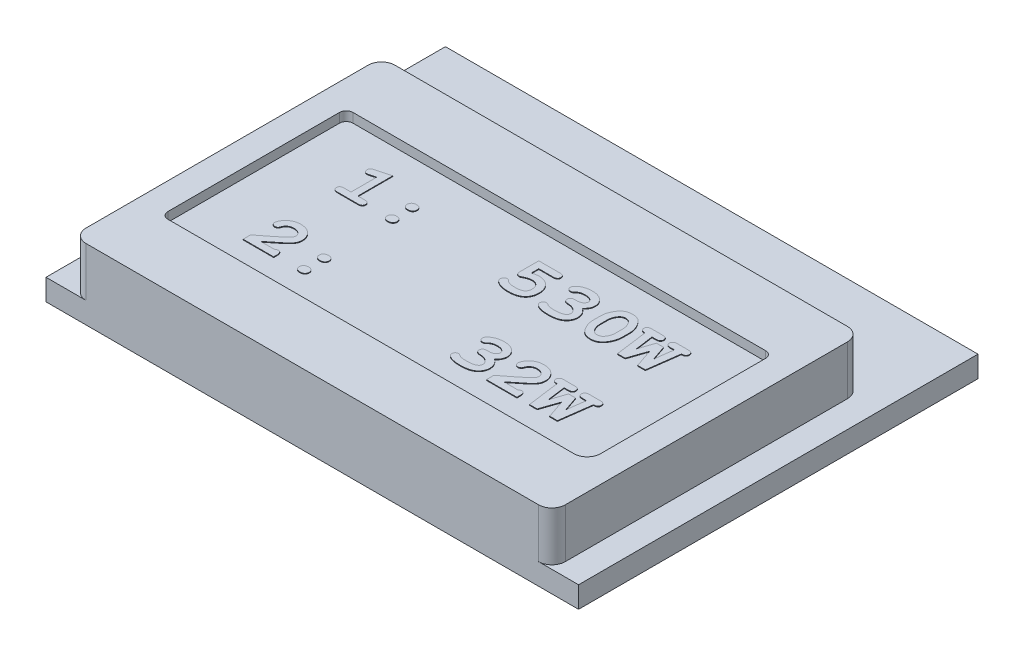
from build123d import *

# Parameters (mm, degrees)
SKETCH1_W           = 40
SKETCH1_H           = 30
BOSS_EXTRUDE1_DEPTH = 1.6
SKETCH5_W           = 36
SKETCH5_H           = 23.2
SKETCH5_W_2         = 32
SKETCH5_H_2         = 13.9
BOSS_EXTRUDE2_DEPTH = 3.7
SKETCH9_W           = 32
SKETCH9_H           = 13.9
BOSS_EXTRUDE3_DEPTH = 3
FILLET5_R           = 0.5
FILLET6_R           = 0.5
FILLET7_R           = 0.5
FILLET8_R           = 1
FILLET9_R           = 1
FILLET10_R          = 1
FILLET11_R          = 1
BOSS_EXTRUDE4_DEPTH = 0.05


with BuildPart() as part:
    # Sketch1 → Boss-Extrude1 (new body)
    with BuildSketch(Plane(origin=(0, 0, 0), x_dir=(1, 0, 0), z_dir=(0, 1, 0))):
        with Locations((20, 15)):
            Rectangle(SKETCH1_W, SKETCH1_H)
    extrude(amount=-BOSS_EXTRUDE1_DEPTH)

    # Sketch5 → Boss-Extrude2 (add)
    with BuildSketch(Plane(origin=(0, 0, 0), x_dir=(1, 0, 0), z_dir=(0, 1, 0))):
        with Locations((20, 11.6)):
            Rectangle(SKETCH5_W, SKETCH5_H)
        with Locations((20, 11.6)):
            Rectangle(SKETCH5_W_2, SKETCH5_H_2, mode=Mode.SUBTRACT)
    extrude(amount=BOSS_EXTRUDE2_DEPTH)

    # Sketch9 → Boss-Extrude3 (add)
    with BuildSketch(Plane(origin=(0, 0, 0), x_dir=(1, 0, 0), z_dir=(0, 1, 0))):
        with Locations((20, 11.6)):
            Rectangle(SKETCH9_W, SKETCH9_H)
    extrude(amount=BOSS_EXTRUDE3_DEPTH)

    # Fillet5
    fillet5_edges = [part.edges().sort_by_distance(p)[0] for p in [
        (4, 3.35, -18.55),
    ]]
    fillet(fillet5_edges, radius=FILLET5_R)

    # Fillet6
    fillet6_edges = [part.edges().sort_by_distance(p)[0] for p in [
        (36, 3.35, -18.55),
    ]]
    fillet(fillet6_edges, radius=FILLET6_R)

    # Fillet7
    fillet7_edges = [part.edges().sort_by_distance(p)[0] for p in [
        (4, 3.35, -4.65),
    ]]
    fillet(fillet7_edges, radius=FILLET7_R)

    # Fillet8
    fillet8_edges = [part.edges().sort_by_distance(p)[0] for p in [
        (36, 3.35, -4.65),
    ]]
    fillet(fillet8_edges, radius=FILLET8_R)

    # Fillet9
    fillet9_edges = [part.edges().sort_by_distance(p)[0] for p in [
        (38, 1.85, -23.2),
        (38, 1.85, 0),
    ]]
    fillet(fillet9_edges, radius=FILLET9_R)

    # Fillet10
    fillet10_edges = [part.edges().sort_by_distance(p)[0] for p in [
        (2, 1.85, 0),
    ]]
    fillet(fillet10_edges, radius=FILLET10_R)

    # Fillet11
    fillet11_edges = [part.edges().sort_by_distance(p)[0] for p in [
        (2, 1.85, -23.2),
    ]]
    fillet(fillet11_edges, radius=FILLET11_R)

    # Sketch10 → Boss-Extrude4 (add)
    # profile 1 of 13: a face of its own
    with BuildSketch(Plane(origin=(0, 3, 0), x_dir=(1, 0, 0), z_dir=(0, 1, 0))):
        with BuildLine():
            Line((9.475469548, 16.573293394), (9.475469548, 13.949975427))
            Line((9.475469548, 13.949975427), (9.990764149, 13.949975427))
            add(Edge.make_bspline(
                [(9.990764149, 13.949975427), (10.017431037, 13.949317465), (10.067524673, 13.948081485), (10.136815221, 13.934359789), (10.195006289, 13.912078823), (10.241081766, 13.879680137), (10.275775821, 13.840395683), (10.300844507, 13.795769223), (10.31581905, 13.745724282), (10.317706385, 13.710485858), (10.318678894, 13.692328127)],
                knots=[0, 0, 0, 0, 1.353154287, 2.541894464, 3.570795155, 4.495901044, 5.373971119, 6.211928534, 7.078638652, 8, 8, 8, 8], degree=3))
            add(Edge.make_bspline(
                [(10.318678894, 13.692328127), (10.317718395, 13.674163566), (10.315854368, 13.638911889), (10.300652266, 13.588754614), (10.276028508, 13.543619834), (10.241031484, 13.504311038), (10.195172739, 13.471684351), (10.136617552, 13.450547622), (10.067558299, 13.436491942), (10.017442719, 13.435310015), (9.990764149, 13.434680826)],
                knots=[0, 0, 0, 0, 0.920639213, 1.786670031, 2.634802021, 3.512183892, 4.436564712, 5.460097794, 6.647906274, 8, 8, 8, 8], degree=3))
            Line((9.990764149, 13.434680826), (8.444880346, 13.434680826))
            add(Edge.make_bspline(
                [(8.444880346, 13.434680826), (8.418207309, 13.43531703), (8.368102123, 13.436512136), (8.298975272, 13.450482113), (8.240440994, 13.47195409), (8.193904646, 13.503810579), (8.159692429, 13.543908703), (8.134950698, 13.58871509), (8.119801373, 13.638922592), (8.117929924, 13.674167206), (8.1169656, 13.692328127)],
                knots=[0, 0, 0, 0, 1.351758791, 2.539273031, 3.562552567, 4.496852515, 5.365850662, 6.213772556, 7.079588844, 8, 8, 8, 8], degree=3))
            add(Edge.make_bspline(
                [(8.1169656, 13.692328127), (8.117941944, 13.710482215), (8.119836717, 13.745713568), (8.134758579, 13.795808584), (8.159941571, 13.840109719), (8.193854023, 13.880180622), (8.240609346, 13.911805467), (8.298777623, 13.934425095), (8.368135717, 13.948061389), (8.418218979, 13.949310483), (8.444880346, 13.949975427)],
                knots=[0, 0, 0, 0, 0.921132933, 1.787628184, 2.62537786, 3.495057466, 4.430090083, 5.458735699, 6.647181174, 8, 8, 8, 8], degree=3))
            Line((8.444880346, 13.949975427), (8.960174947, 13.949975427))
            Line((8.960174947, 13.949975427), (8.960174947, 15.884526037))
            Line((8.960174947, 15.884526037), (8.512951934, 15.760826055))
            add(Edge.make_bspline(
                [(8.512951934, 15.760826055), (8.49614952, 15.75630085), (8.46511161, 15.747941758), (8.421446735, 15.738208733), (8.38454626, 15.731928661), (8.361942744, 15.730650618), (8.351922372, 15.730084048)],
                knots=[0, 0, 0, 0, 1.270781935, 2.347425591, 3.26739664, 4, 4, 4, 4], degree=3))
            add(Edge.make_bspline(
                [(8.351922372, 15.730084048), (8.336438977, 15.73110823), (8.305738442, 15.733138982), (8.26144944, 15.748358995), (8.220987819, 15.774274607), (8.185106617, 15.809375025), (8.154237158, 15.851070413), (8.133117167, 15.899180954), (8.119226399, 15.951087844), (8.117732476, 15.987393432), (8.1169656, 16.006030162)],
                knots=[0, 0, 0, 0, 0.923352542, 1.830826988, 2.76036353, 3.769997797, 4.813123367, 5.836638213, 6.889482554, 8, 8, 8, 8], degree=3))
            add(Edge.make_bspline(
                [(8.1169656, 16.006030162), (8.117331669, 16.022688536), (8.118034078, 16.054652511), (8.128738544, 16.099578015), (8.144592266, 16.139315587), (8.168448894, 16.174447275), (8.203971679, 16.204974286), (8.252370002, 16.232101208), (8.314518579, 16.257368303), (8.361052659, 16.271418279), (8.386324142, 16.279048466)],
                knots=[0, 0, 0, 0, 0.943798655, 1.810954488, 2.606044375, 3.363165329, 4.197373365, 5.240587811, 6.501432973, 8, 8, 8, 8], degree=3))
            Line((8.386324142, 16.279048466), (9.475469548, 16.573293394))
        make_face()
    # profile 2 of 13: a face of its own
    with BuildSketch(Plane(origin=(0, 3, 0), x_dir=(1, 0, 0), z_dir=(0, 1, 0))):
        with BuildLine():
            add(Edge.make_bspline(
                [(12.614082116, 15.261634411), (12.612808758, 15.239051055), (12.61034133, 15.195290525), (12.591151249, 15.132283871), (12.559331018, 15.07527152), (12.514856338, 15.025540567), (12.460257369, 14.983521871), (12.394478369, 14.954592651), (12.319817855, 14.93658113), (12.267004873, 14.934703726), (12.239322406, 14.933719665)],
                knots=[0, 0, 0, 0, 0.968469795, 1.876636639, 2.800619715, 3.750724702, 4.722983893, 5.735720391, 6.813154619, 8, 8, 8, 8], degree=3))
            add(Edge.make_bspline(
                [(12.239322406, 14.933719665), (12.211644361, 14.934709059), (12.158839814, 14.93659664), (12.084121639, 14.954538598), (12.018362748, 14.983788202), (11.963065583, 15.025036152), (11.919395393, 15.07556443), (11.887452037, 15.132244663), (11.868314592, 15.195301014), (11.865839836, 15.239054626), (11.864562697, 15.261634411)],
                knots=[0, 0, 0, 0, 1.186626495, 2.263862014, 3.276411736, 4.256864745, 5.199896796, 6.123709464, 7.031708817, 8, 8, 8, 8], degree=3))
            add(Edge.make_bspline(
                [(11.864562697, 15.261634411), (11.865851369, 15.284207547), (11.868348472, 15.327948277), (11.887263511, 15.390891232), (11.919647497, 15.447062025), (11.963010318, 15.497572191), (12.018554057, 15.538588288), (12.083913532, 15.568936666), (12.158870817, 15.586606179), (12.211655023, 15.588537064), (12.239322406, 15.589549157)],
                knots=[0, 0, 0, 0, 0.968866686, 1.877405708, 2.79263079, 3.736223331, 4.717259072, 5.734792462, 6.812668235, 8, 8, 8, 8], degree=3))
            add(Edge.make_bspline(
                [(12.239322406, 15.589549157), (12.266994201, 15.588542376), (12.319786825, 15.586621626), (12.39468649, 15.568882739), (12.460067827, 15.538857628), (12.514911388, 15.497067805), (12.559076082, 15.447352611), (12.591339871, 15.390852149), (12.610307471, 15.327958776), (12.612797233, 15.284211121), (12.614082116, 15.261634411)],
                knots=[0, 0, 0, 0, 1.187550912, 2.26562563, 3.283346827, 4.256183986, 5.206853771, 6.122247778, 7.030954489, 8, 8, 8, 8], degree=3))
        make_face()
    # profile 3 of 13: a face of its own
    with BuildSketch(Plane(origin=(0, 3, 0), x_dir=(1, 0, 0), z_dir=(0, 1, 0))):
        with BuildLine():
            add(Edge.make_bspline(
                [(12.614082116, 13.762595572), (12.612808758, 13.740012217), (12.61034133, 13.696251686), (12.591151249, 13.633245032), (12.559331018, 13.576232682), (12.514856338, 13.526501729), (12.460257369, 13.484483033), (12.394478369, 13.455553813), (12.319817855, 13.437542292), (12.267004873, 13.435664887), (12.239322406, 13.434680826)],
                knots=[0, 0, 0, 0, 0.968469795, 1.876636639, 2.800619715, 3.750724702, 4.722983893, 5.735720391, 6.813154619, 8, 8, 8, 8], degree=3))
            add(Edge.make_bspline(
                [(12.239322406, 13.434680826), (12.211644361, 13.435670221), (12.158839814, 13.437557801), (12.084121639, 13.455499759), (12.018362748, 13.484749364), (11.963065583, 13.525997313), (11.919395393, 13.576525592), (11.887452037, 13.633205824), (11.868314592, 13.696262175), (11.865839836, 13.740015787), (11.864562697, 13.762595572)],
                knots=[0, 0, 0, 0, 1.186626495, 2.263862014, 3.276411736, 4.256864745, 5.199896796, 6.123709464, 7.031708817, 8, 8, 8, 8], degree=3))
            add(Edge.make_bspline(
                [(11.864562697, 13.762595572), (11.865851369, 13.785168709), (11.868348472, 13.828909439), (11.887263511, 13.891852394), (11.919647497, 13.948023187), (11.963010318, 13.998533352), (12.018554057, 14.03954945), (12.083913532, 14.069897827), (12.158870817, 14.087567341), (12.211655023, 14.089498225), (12.239322406, 14.090510318)],
                knots=[0, 0, 0, 0, 0.968866686, 1.877405708, 2.79263079, 3.736223331, 4.717259072, 5.734792462, 6.812668235, 8, 8, 8, 8], degree=3))
            add(Edge.make_bspline(
                [(12.239322406, 14.090510318), (12.266994201, 14.089503537), (12.319786825, 14.087582788), (12.39468649, 14.069843901), (12.460067827, 14.039818789), (12.514911388, 13.998028967), (12.559076082, 13.948313772), (12.591339871, 13.89181331), (12.610307471, 13.828919938), (12.612797233, 13.785172283), (12.614082116, 13.762595572)],
                knots=[0, 0, 0, 0, 1.187550912, 2.26562563, 3.283346827, 4.256183986, 5.206853771, 6.122247778, 7.030954489, 8, 8, 8, 8], degree=3))
        make_face()
    # profile 4 of 13: a face of its own
    with BuildSketch(Plane(origin=(0, 3, 0), x_dir=(1, 0, 0), z_dir=(0, 1, 0))):
        with BuildLine():
            Line((20.999330619, 16.01115383), (20.999330619, 15.449014266))
            add(Edge.make_bspline(
                [(20.999330619, 15.449014266), (21.045015036, 15.46335164), (21.13318765, 15.491023302), (21.264342709, 15.52029148), (21.38891677, 15.539027868), (21.470159779, 15.541504762), (21.509501552, 15.542704193)],
                knots=[0, 0, 0, 0, 1.102835618, 2.128513544, 3.093736242, 4, 4, 4, 4], degree=3))
            add(Edge.make_bspline(
                [(21.509501552, 15.542704193), (21.54759819, 15.541613745), (21.622339772, 15.5394744), (21.732049132, 15.52579473), (21.836465551, 15.501052698), (21.936650143, 15.468629759), (22.031455185, 15.424994745), (22.120998255, 15.371967718), (22.206105401, 15.310026783), (22.284987585, 15.238609674), (22.357611191, 15.16029719), (22.419743398, 15.074508325), (22.473781567, 14.984504955), (22.51730168, 14.888183251), (22.550721715, 14.786279025), (22.575068802, 14.678982255), (22.588878264, 14.566151613), (22.590983484, 14.489217299), (22.592059385, 14.449899024)],
                knots=[0, 0, 0, 0, 1.060741973, 2.081063785, 3.071344896, 4.044422851, 5.007994351, 5.970272048, 6.937643031, 7.933314478, 8.928522391, 9.905386472, 10.876969592, 11.846722562, 12.841281164, 13.858046772, 14.905327145, 16, 16, 16, 16], degree=3))
            add(Edge.make_bspline(
                [(22.592059385, 14.449899024), (22.591052241, 14.409599837), (22.589085958, 14.330922273), (22.574436925, 14.216128678), (22.549403258, 14.108094915), (22.515442002, 14.006393392), (22.469928986, 13.912023214), (22.416098091, 13.823507931), (22.350760062, 13.742768148), (22.276783871, 13.668162702), (22.191641968, 13.601919261), (22.096238928, 13.543930925), (21.989896499, 13.495717325), (21.873525881, 13.456553008), (21.747100123, 13.424715056), (21.609875407, 13.403561928), (21.462195188, 13.390098127), (21.360215025, 13.388606935), (21.307482646, 13.387835863)],
                knots=[0, 0, 0, 0, 1.018777828, 1.988996889, 2.919759424, 3.819081362, 4.693777292, 5.563477473, 6.432477271, 7.313610214, 8.214454206, 9.15287177, 10.130047576, 11.160081318, 12.25378074, 13.422108514, 14.6670118, 16, 16, 16, 16], degree=3))
            add(Edge.make_bspline(
                [(21.307482646, 13.387835863), (21.260866184, 13.388591972), (21.16995714, 13.390066498), (21.037142275, 13.399971014), (20.912013875, 13.418361913), (20.794214568, 13.443392595), (20.68339484, 13.474047889), (20.580861646, 13.514073469), (20.485133612, 13.559860824), (20.426608559, 13.597071141), (20.397665616, 13.615473108)],
                knots=[0, 0, 0, 0, 1.175719635, 2.29282846, 3.356261568, 4.362804353, 5.328922208, 6.252274149, 7.135680755, 8, 8, 8, 8], degree=3))
            add(Edge.make_bspline(
                [(20.397665616, 13.615473108), (20.382351083, 13.626455914), (20.352835268, 13.647623158), (20.313020557, 13.68224172), (20.278806191, 13.717869729), (20.25200978, 13.755839904), (20.228899072, 13.793604441), (20.214853381, 13.834130267), (20.204408676, 13.875029578), (20.203446072, 13.903063347), (20.202966236, 13.917037562)],
                knots=[0, 0, 0, 0, 1.208026182, 2.328238004, 3.379905042, 4.365840465, 5.305229763, 6.206303803, 7.105882058, 8, 8, 8, 8], degree=3))
            add(Edge.make_bspline(
                [(20.202966236, 13.917037562), (20.204067956, 13.934436139), (20.206245108, 13.968818158), (20.220088144, 14.018790324), (20.245477218, 14.064143486), (20.277921783, 14.105332318), (20.316833479, 14.14065112), (20.361398621, 14.165794877), (20.409597889, 14.181261444), (20.442932836, 14.183209686), (20.459881584, 14.184200246)],
                knots=[0, 0, 0, 0, 1.018144574, 2.011995917, 3.001740419, 4.038124235, 5.069188681, 6.053361763, 7.010255498, 8, 8, 8, 8], degree=3))
            add(Edge.make_bspline(
                [(20.459881584, 14.184200246), (20.474919411, 14.18297468), (20.506435793, 14.180406133), (20.553674959, 14.160951781), (20.602209938, 14.13030903), (20.650147898, 14.088530458), (20.699593065, 14.044909727), (20.752828606, 14.008107368), (20.807123394, 13.978061393), (20.845171885, 13.964149644), (20.863919395, 13.957294953)],
                knots=[0, 0, 0, 0, 0.76594545, 1.605273703, 2.572605551, 3.686851738, 4.844154264, 5.935490503, 6.982760859, 8, 8, 8, 8], degree=3))
            add(Edge.make_bspline(
                [(20.863919395, 13.957294953), (20.892328426, 13.948911002), (20.952119002, 13.931265867), (21.049370313, 13.915505343), (21.157444765, 13.905068978), (21.233281772, 13.903797652), (21.273080875, 13.903130463)],
                knots=[0, 0, 0, 0, 0.857181626, 1.804052485, 2.847571293, 4, 4, 4, 4], degree=3))
            add(Edge.make_bspline(
                [(21.273080875, 13.903130463), (21.310170168, 13.903618966), (21.381469716, 13.904558052), (21.483908761, 13.909788085), (21.577174148, 13.921085982), (21.66110306, 13.93522099), (21.736079661, 13.953484653), (21.801999849, 13.975714418), (21.85904142, 14.002585179), (21.907078998, 14.0345733), (21.947058383, 14.071647884), (21.9828012, 14.111399616), (22.011097708, 14.15724019), (22.035858777, 14.20617266), (22.053513892, 14.260377271), (22.068140125, 14.318189627), (22.074717575, 14.380948883), (22.07606836, 14.424028632), (22.076764784, 14.446239261)],
                knots=[0, 0, 0, 0, 1.59325641, 3.062837137, 4.403036822, 5.626316526, 6.716730796, 7.714305849, 8.609587007, 9.417628094, 10.181799609, 10.946832972, 11.705595759, 12.488298347, 13.296950841, 14.148471668, 15.045407408, 16, 16, 16, 16], degree=3))
            add(Edge.make_bspline(
                [(22.076764784, 14.446239261), (22.076494311, 14.468228326), (22.075963424, 14.511388585), (22.067385176, 14.574004603), (22.055277032, 14.633151985), (22.037668919, 14.688392577), (22.01468807, 14.740077726), (21.987145311, 14.788465833), (21.953779932, 14.832822517), (21.915508434, 14.87280942), (21.874144381, 14.90943923), (21.829241256, 14.941146682), (21.781201695, 14.967461933), (21.730632857, 14.989747888), (21.676974216, 15.006205312), (21.620776113, 15.019024267), (21.561421594, 15.026343558), (21.520744336, 15.027049394), (21.499986168, 15.027409592)],
                knots=[0, 0, 0, 0, 1.141888158, 2.241304515, 3.278404235, 4.276956462, 5.247747547, 6.213473528, 7.164518782, 8.124315653, 9.085786396, 10.032170673, 10.974383023, 11.928466767, 12.899009367, 13.88655079, 14.921477596, 16, 16, 16, 16], degree=3))
            add(Edge.make_bspline(
                [(21.499986168, 15.027409592), (21.476779678, 15.026832116), (21.429476409, 15.02565501), (21.357340761, 15.016216284), (21.282603957, 15.001913039), (21.205914565, 14.979946264), (21.126395483, 14.954061104), (21.045340068, 14.920208605), (20.960771688, 14.882818612), (20.904974574, 14.853082265), (20.876362589, 14.83783388)],
                knots=[0, 0, 0, 0, 0.845802563, 1.724053298, 2.648651512, 3.617627319, 4.630286403, 5.695719479, 6.818396977, 8, 8, 8, 8], degree=3))
            add(Edge.make_bspline(
                [(20.876362589, 14.83783388), (20.863817776, 14.830950455), (20.840020719, 14.817892846), (20.803906257, 14.803831691), (20.770131234, 14.795328935), (20.748311033, 14.793871775), (20.738023556, 14.793184774)],
                knots=[0, 0, 0, 0, 1.168135965, 2.215911687, 3.158863469, 4, 4, 4, 4], degree=3))
            add(Edge.make_bspline(
                [(20.738023556, 14.793184774), (20.720587798, 14.794158193), (20.68653178, 14.796059502), (20.637873324, 14.811367411), (20.59357143, 14.836020835), (20.554922471, 14.870539367), (20.523596882, 14.913061878), (20.500345794, 14.961921098), (20.48617744, 15.016617409), (20.484764235, 15.055137367), (20.484036018, 15.074986508)],
                knots=[0, 0, 0, 0, 0.984689337, 1.923323188, 2.856359281, 3.83405941, 4.83057525, 5.824507083, 6.878979419, 8, 8, 8, 8], degree=3))
            Line((20.484036018, 15.074986508), (20.484036018, 16.526448431))
            Line((20.484036018, 16.526448431), (22.059929875, 16.526448431))
            add(Edge.make_bspline(
                [(22.059929875, 16.526448431), (22.088774585, 16.525726036), (22.142424765, 16.524382407), (22.216684145, 16.511737191), (22.278118424, 16.489704477), (22.326236526, 16.457360494), (22.361111273, 16.417243063), (22.386995602, 16.372424952), (22.401768916, 16.321424962), (22.403689855, 16.285728287), (22.40467953, 16.267337225)],
                knots=[0, 0, 0, 0, 1.411392211, 2.625141547, 3.67233506, 4.583489228, 5.429683996, 6.253491854, 7.100192367, 8, 8, 8, 8], degree=3))
            add(Edge.make_bspline(
                [(22.40467953, 16.267337225), (22.403667931, 16.249436905), (22.401691819, 16.214469458), (22.387016303, 16.164391749), (22.360883092, 16.120240007), (22.326244134, 16.080283419), (22.278266003, 16.047700743), (22.216418748, 16.027054301), (22.142554094, 16.012846382), (22.088804261, 16.01174532), (22.059929875, 16.01115383)],
                knots=[0, 0, 0, 0, 0.881266442, 1.721513215, 2.539818548, 3.391078423, 4.307686527, 5.356958996, 6.580159555, 8, 8, 8, 8], degree=3))
            Line((22.059929875, 16.01115383), (20.999330619, 16.01115383))
        make_face()
    # profile 5 of 13: a face of its own
    with BuildSketch(Plane(origin=(0, 3, 0), x_dir=(1, 0, 0), z_dir=(0, 1, 0))):
        with BuildLine():
            add(Edge.make_bspline(
                [(25.207325874, 15.077914319), (25.24157221, 15.053264151), (25.30834976, 15.005198346), (25.396574708, 14.922652447), (25.471454093, 14.834454365), (25.531787944, 14.739945297), (25.579480311, 14.64000441), (25.613061288, 14.534135711), (25.633370448, 14.422376005), (25.635763218, 14.346047694), (25.636982025, 14.307168275)],
                knots=[0, 0, 0, 0, 1.097993425, 2.140997182, 3.137620899, 4.103529464, 5.052847346, 6.013390642, 6.988079051, 8, 8, 8, 8], degree=3))
            add(Edge.make_bspline(
                [(25.636982025, 14.307168275), (25.63512965, 14.264809067), (25.631459001, 14.180870478), (25.602666288, 14.057730116), (25.554881205, 13.940120899), (25.489981046, 13.828250006), (25.407133815, 13.724912645), (25.305383532, 13.635275224), (25.187511342, 13.558502461), (25.077188336, 13.506924373), (24.980756533, 13.472157307), (24.901500708, 13.449530044), (24.81657307, 13.43098024), (24.726596823, 13.414412612), (24.630953639, 13.403254915), (24.530143762, 13.394589957), (24.42372863, 13.388212434), (24.350951277, 13.387963554), (24.313611801, 13.387835863)],
                knots=[0, 0, 0, 0, 1.120613339, 2.220596324, 3.327706112, 4.471024442, 5.63314614, 6.818092964, 8.045313244, 9.34554775, 10.032061611, 10.75783771, 11.525709624, 12.33281483, 13.1788628, 14.07361304, 15.011639225, 16, 16, 16, 16], degree=3))
            add(Edge.make_bspline(
                [(24.313611801, 13.387835863), (24.265289008, 13.38836072), (24.171730477, 13.389376905), (24.036147661, 13.398215529), (23.909812255, 13.412670269), (23.792643911, 13.432819802), (23.684844849, 13.459206794), (23.58596427, 13.490405646), (23.496157862, 13.527881811), (23.441812268, 13.559283581), (23.415506012, 13.574483765)],
                knots=[0, 0, 0, 0, 1.249332019, 2.418851671, 3.511219396, 4.535913872, 5.490662898, 6.378455454, 7.215083279, 8, 8, 8, 8], degree=3))
            add(Edge.make_bspline(
                [(23.415506012, 13.574483765), (23.39029254, 13.592057462), (23.343173546, 13.624899229), (23.288200112, 13.686164951), (23.253761352, 13.754262547), (23.249828183, 13.802494148), (23.247888876, 13.826275445)],
                knots=[0, 0, 0, 0, 1.164370679, 2.175978608, 3.10063958, 4, 4, 4, 4], degree=3))
            add(Edge.make_bspline(
                [(23.247888876, 13.826275445), (23.248623642, 13.844182872), (23.250057018, 13.879116556), (23.264518892, 13.929256967), (23.288439759, 13.974627648), (23.320713013, 14.01462126), (23.359065819, 14.048380992), (23.402859812, 14.07311269), (23.450998746, 14.08735403), (23.484218246, 14.089444943), (23.501144461, 14.090510318)],
                knots=[0, 0, 0, 0, 1.053709269, 2.055568736, 3.046523993, 4.059783181, 5.069359267, 6.041869181, 7.002280465, 8, 8, 8, 8], degree=3))
            add(Edge.make_bspline(
                [(23.501144461, 14.090510318), (23.513399957, 14.089964819), (23.538514696, 14.088846948), (23.576107877, 14.078771961), (23.613974805, 14.062136197), (23.638413206, 14.047605364), (23.651194736, 14.040005592)],
                knots=[0, 0, 0, 0, 0.915178223, 1.87544133, 2.888834431, 4, 4, 4, 4], degree=3))
            add(Edge.make_bspline(
                [(23.651194736, 14.040005592), (23.669036807, 14.027941574), (23.703620624, 14.004557529), (23.756877422, 13.976608841), (23.808031541, 13.95358265), (23.842350603, 13.943282125), (23.859069262, 13.938264186)],
                knots=[0, 0, 0, 0, 1.1106095, 2.152727439, 3.100094243, 4, 4, 4, 4], degree=3))
            add(Edge.make_bspline(
                [(23.859069262, 13.938264186), (23.886328926, 13.932724167), (23.945369005, 13.920725369), (24.042106467, 13.91082264), (24.15272841, 13.904153193), (24.231131935, 13.903484389), (24.272622457, 13.903130463)],
                knots=[0, 0, 0, 0, 0.802341852, 1.737744341, 2.802832264, 4, 4, 4, 4], degree=3))
            add(Edge.make_bspline(
                [(24.272622457, 13.903130463), (24.308740189, 13.90331334), (24.378331782, 13.903665708), (24.478656624, 13.90907932), (24.571500749, 13.916763113), (24.65651371, 13.928337376), (24.733958254, 13.943008686), (24.803632635, 13.960074693), (24.865641688, 13.981312105), (24.920145435, 14.006032447), (24.967280022, 14.034396956), (25.009207045, 14.063966281), (25.043397639, 14.098220594), (25.072693513, 14.133720893), (25.093961025, 14.173022925), (25.110518544, 14.214095922), (25.120248425, 14.258655336), (25.121200846, 14.289310918), (25.121687425, 14.304972418)],
                knots=[0, 0, 0, 0, 1.664961625, 3.208045717, 4.630774554, 5.959123334, 7.161473497, 8.263675248, 9.263292933, 10.179355466, 11.016610455, 11.797323049, 12.537091691, 13.241552207, 13.911299522, 14.588094531, 15.278677607, 16, 16, 16, 16], degree=3))
            add(Edge.make_bspline(
                [(25.121687425, 14.304972418), (25.120233463, 14.328556214), (25.11727877, 14.376482459), (25.094012134, 14.446928135), (25.056216223, 14.515334541), (25.004988766, 14.581115445), (24.94200374, 14.643099125), (24.868651599, 14.699185044), (24.784088665, 14.745973364), (24.723293963, 14.77086782), (24.692031273, 14.78366939)],
                knots=[0, 0, 0, 0, 0.829101777, 1.68487435, 2.584325579, 3.570530774, 4.609210476, 5.688136217, 6.811161537, 8, 8, 8, 8], degree=3))
            add(Edge.make_bspline(
                [(24.692031273, 14.78366939), (24.670163992, 14.790138912), (24.620426325, 14.804853997), (24.534359342, 14.81995236), (24.429000601, 14.831950466), (24.352191918, 14.837195361), (24.31068399, 14.840029737)],
                knots=[0, 0, 0, 0, 0.707695204, 1.609670054, 2.708249672, 4, 4, 4, 4], degree=3))
            add(Edge.make_bspline(
                [(24.31068399, 14.840029737), (24.290553874, 14.841737652), (24.251844559, 14.845021896), (24.19810355, 14.861434392), (24.151231221, 14.885175511), (24.112063942, 14.916669284), (24.081794145, 14.955265267), (24.060524367, 14.998497677), (24.046492991, 15.04558133), (24.045013519, 15.078543066), (24.044253259, 15.09548118)],
                knots=[0, 0, 0, 0, 1.174407561, 2.258333205, 3.250248562, 4.220533013, 5.161954548, 6.083851395, 7.015344777, 8, 8, 8, 8], degree=3))
            add(Edge.make_bspline(
                [(24.044253259, 15.09548118), (24.045309069, 15.113134765), (24.047367283, 15.147548984), (24.061468957, 15.197205223), (24.086375579, 15.241912351), (24.120185871, 15.281168193), (24.160807698, 15.3143678), (24.208118789, 15.337869707), (24.26017926, 15.353447019), (24.296903226, 15.354686361), (24.315807658, 15.355324338)],
                knots=[0, 0, 0, 0, 1.010030714, 1.968972296, 2.925063514, 3.915506611, 4.918564833, 5.9051623, 6.921638344, 8, 8, 8, 8], degree=3))
            add(Edge.make_bspline(
                [(24.315807658, 15.355324338), (24.336302492, 15.355310009), (24.374852298, 15.355283056), (24.428770824, 15.35545809), (24.475136078, 15.354931348), (24.513914737, 15.356445751), (24.54516703, 15.355544471), (24.56880308, 15.357180389), (24.584708497, 15.356353918), (24.592731769, 15.357228026), (24.595413535, 15.357520196)],
                knots=[0, 0, 0, 0, 1.758838091, 3.308290695, 4.627419264, 5.737359861, 6.637717455, 7.308078099, 7.76872617, 8, 8, 8, 8], degree=3))
            add(Edge.make_bspline(
                [(24.595413535, 15.357520196), (24.629836859, 15.362427913), (24.700325919, 15.372477507), (24.78501254, 15.404060949), (24.849045896, 15.438066336), (24.893262498, 15.468525992), (24.931875562, 15.503716616), (24.965599048, 15.542476541), (24.993447219, 15.583563907), (25.013362114, 15.626294245), (25.026103757, 15.669819649), (25.027366105, 15.699257225), (25.027997497, 15.713981091)],
                knots=[0, 0, 0, 0, 1.705904954, 3.493202395, 4.405554013, 5.26737996, 6.125105736, 6.966914965, 7.788657641, 8.55607468, 9.277788216, 10, 10, 10, 10], degree=3))
            add(Edge.make_bspline(
                [(25.027997497, 15.713981091), (25.02606123, 15.736692648), (25.02217395, 15.782288734), (24.993148934, 15.847643594), (24.944816674, 15.906282518), (24.891933099, 15.9492329), (24.841809602, 15.981108421), (24.797664493, 16.000979837), (24.749566303, 16.018860254), (24.6967198, 16.033529255), (24.639096691, 16.044027579), (24.577051035, 16.052111071), (24.510598889, 16.057415914), (24.46464855, 16.057800584), (24.440971546, 16.057998794)],
                knots=[0, 0, 0, 0, 1.084602185, 2.177464787, 3.356977091, 4.691657344, 5.420460965, 6.193363759, 7.002190418, 7.874483261, 8.81314141, 9.802061222, 10.867459781, 12, 12, 12, 12], degree=3))
            add(Edge.make_bspline(
                [(24.440971546, 16.057998794), (24.410442601, 16.057281367), (24.350915395, 16.055882486), (24.264478832, 16.045467254), (24.183222965, 16.028950966), (24.107701805, 16.004729008), (24.037686184, 15.973958839), (23.97332999, 15.936491394), (23.914900194, 15.8915296), (23.880642133, 15.856641907), (23.863460978, 15.839144979)],
                knots=[0, 0, 0, 0, 1.15112623, 2.244536446, 3.278607213, 4.273832925, 5.229609485, 6.157563074, 7.075978242, 8, 8, 8, 8], degree=3))
            add(Edge.make_bspline(
                [(23.863460978, 15.839144979), (23.854255324, 15.829565202), (23.837156154, 15.811771112), (23.812484759, 15.788004563), (23.790145195, 15.770305084), (23.775465676, 15.761675993), (23.769039098, 15.757898245)],
                knots=[0, 0, 0, 0, 1.274654296, 2.367624473, 3.285358848, 4, 4, 4, 4], degree=3))
            add(Edge.make_bspline(
                [(23.769039098, 15.757898245), (23.750511589, 15.749967314), (23.712181214, 15.733559519), (23.670521699, 15.731267954), (23.648998878, 15.730084048)],
                knots=[0, 0, 0, 0, 0.966727216, 2, 2, 2, 2], degree=3))
            add(Edge.make_bspline(
                [(23.648998878, 15.730084048), (23.631583278, 15.73112571), (23.597636774, 15.73315612), (23.548344418, 15.747580049), (23.503612818, 15.772236151), (23.463250322, 15.804916373), (23.430604529, 15.845278951), (23.405585938, 15.890389491), (23.391551823, 15.940810083), (23.389484254, 15.975694335), (23.388423768, 15.993586969)],
                knots=[0, 0, 0, 0, 1.013995654, 1.976481225, 2.962192537, 3.972196067, 4.982199597, 5.967910909, 6.957712327, 8, 8, 8, 8], degree=3))
            add(Edge.make_bspline(
                [(23.388423768, 15.993586969), (23.389142273, 16.008050547), (23.390599494, 16.037384521), (23.402323235, 16.081074295), (23.420719212, 16.124464959), (23.446748857, 16.1672362), (23.480540965, 16.209150356), (23.520646087, 16.251564332), (23.568491892, 16.293389986), (23.604124824, 16.319110306), (23.622648586, 16.332481003)],
                knots=[0, 0, 0, 0, 0.810402016, 1.643598185, 2.520607143, 3.447764793, 4.441714979, 5.535699057, 6.718934318, 8, 8, 8, 8], degree=3))
            add(Edge.make_bspline(
                [(23.622648586, 16.332481003), (23.651592723, 16.351817082), (23.70986571, 16.390746247), (23.803736646, 16.439312178), (23.902787009, 16.480463183), (24.006625424, 16.515020338), (24.116314851, 16.541504574), (24.231209263, 16.558967949), (24.351151362, 16.571601678), (24.432884927, 16.572721364), (24.474641363, 16.573293394)],
                knots=[0, 0, 0, 0, 0.928115393, 1.868566895, 2.813939142, 3.78759634, 4.78541168, 5.820270149, 6.886409155, 8, 8, 8, 8], degree=3))
            add(Edge.make_bspline(
                [(24.474641363, 16.573293394), (24.513953634, 16.572680019), (24.590810392, 16.57148085), (24.703144974, 16.559507698), (24.809694172, 16.539999034), (24.910057466, 16.512129847), (25.004562646, 16.477037977), (25.092846091, 16.433646542), (25.175345758, 16.382254133), (25.250814802, 16.322999162), (25.319335254, 16.259225516), (25.379241707, 16.191370511), (25.430044775, 16.120366604), (25.471397484, 16.0456571), (25.503946264, 15.967918314), (25.526379522, 15.886730298), (25.541098453, 15.802595037), (25.542553488, 15.745274289), (25.543292098, 15.716176949)],
                knots=[0, 0, 0, 0, 1.233992393, 2.412494953, 3.54241272, 4.631575179, 5.67884524, 6.703253749, 7.715066888, 8.72493504, 9.711372461, 10.650413377, 11.562344842, 12.447065873, 13.326297166, 14.201815995, 15.087200136, 16, 16, 16, 16], degree=3))
            add(Edge.make_bspline(
                [(25.543292098, 15.716176949), (25.54237811, 15.686092559), (25.540559029, 15.626216574), (25.523775141, 15.538232009), (25.497319674, 15.453212921), (25.460297642, 15.371461144), (25.413100559, 15.292487014), (25.354843537, 15.217142486), (25.286092996, 15.144612104), (25.234123929, 15.100606159), (25.207325874, 15.077914319)],
                knots=[0, 0, 0, 0, 0.965442285, 1.921488469, 2.865804375, 3.819825069, 4.796869706, 5.814099319, 6.872831634, 8, 8, 8, 8], degree=3))
        make_face()
    # profile 6 of 13: a face of its own
    with BuildSketch(Plane(origin=(0, 3, 0), x_dir=(1, 0, 0), z_dir=(0, 1, 0))):
        with BuildLine():
            Line((28.588214739, 15.244799502), (28.588214739, 14.716329755))
            add(Edge.make_bspline(
                [(28.588214739, 14.716329755), (28.587347219, 14.677503991), (28.585612676, 14.599874705), (28.572282558, 14.484015659), (28.549111475, 14.369704398), (28.518601669, 14.256203899), (28.478000582, 14.144294438), (28.4288906, 14.033469446), (28.370512988, 13.924141832), (28.305176355, 13.817039383), (28.232141552, 13.716113842), (28.148559467, 13.628540431), (28.058155116, 13.553426667), (27.959021216, 13.493221793), (27.852563758, 13.445752769), (27.738322529, 13.412443217), (27.616488202, 13.39112581), (27.53258744, 13.388951227), (27.489553949, 13.387835863)],
                knots=[0, 0, 0, 0, 0.971019676, 1.941483053, 2.912119109, 3.886259658, 4.878469092, 5.886615663, 6.915820872, 7.976093377, 9.023342033, 10.024816973, 10.996085921, 11.954811881, 12.916485626, 13.903180808, 14.924521679, 16, 16, 16, 16], degree=3))
            add(Edge.make_bspline(
                [(27.489553949, 13.387835863), (27.44064551, 13.389258195), (27.345852002, 13.392014937), (27.209799815, 13.416703458), (27.084884662, 13.455741723), (26.990198211, 13.503613275), (26.919799238, 13.551125925), (26.86805581, 13.593466033), (26.817544832, 13.643264382), (26.76689557, 13.698543932), (26.718062337, 13.76150014), (26.668923847, 13.830164129), (26.620554784, 13.905899628), (26.573732988, 13.98737522), (26.529644347, 14.073007803), (26.492377513, 14.161449589), (26.45837332, 14.250368728), (26.432592177, 14.341126777), (26.411688374, 14.43320366), (26.397392631, 14.526402496), (26.388114919, 14.620988015), (26.387042711, 14.684345827), (26.386501444, 14.716329755)],
                knots=[0, 0, 0, 0, 1.524826776, 2.95539341, 4.298758133, 5.595879437, 6.248304348, 6.946220893, 7.678380056, 8.459815534, 9.283739708, 10.162495588, 11.093759976, 12.086150119, 13.093896524, 14.096482874, 15.079249328, 16.062192671, 17.037352254, 18.023591704, 19.002280885, 20, 20, 20, 20], degree=3))
            Line((26.386501444, 14.716329755), (26.386501444, 15.244799502))
            add(Edge.make_bspline(
                [(26.386501444, 15.244799502), (26.387335969, 15.283631186), (26.388999329, 15.361029836), (26.402726058, 15.476276467), (26.424571619, 15.590637811), (26.45633805, 15.703487056), (26.495826907, 15.815759083), (26.545310861, 15.925967199), (26.602572771, 16.035730501), (26.668094866, 16.142638431), (26.741360448, 16.243540781), (26.824381989, 16.33194605), (26.915261384, 16.406575318), (27.013367753, 16.468264702), (27.120012824, 16.515286853), (27.234182132, 16.54871116), (27.355795217, 16.569954402), (27.439447274, 16.572163476), (27.482234424, 16.573293394)],
                knots=[0, 0, 0, 0, 0.972235727, 1.937843635, 2.902523111, 3.885395743, 4.871037516, 5.880446633, 6.908092659, 7.96969299, 9.018253162, 10.025422005, 10.997907315, 11.955848235, 12.918726327, 13.906657192, 14.929277132, 16, 16, 16, 16], degree=3))
            add(Edge.make_bspline(
                [(27.482234424, 16.573293394), (27.530888877, 16.57180815), (27.624895534, 16.568938468), (27.760321976, 16.545179057), (27.884395939, 16.506162432), (27.978965678, 16.45850114), (28.049429262, 16.411894821), (28.101096889, 16.369409928), (28.151844253, 16.320370171), (28.202877674, 16.265239298), (28.252467824, 16.202482655), (28.301994856, 16.133472933), (28.35041137, 16.057231689), (28.398121186, 15.976002885), (28.44275758, 15.890294953), (28.481273296, 15.801885), (28.514414714, 15.712245972), (28.541859853, 15.621415695), (28.561769724, 15.529004845), (28.577801513, 15.435571736), (28.586448316, 15.340607172), (28.587625169, 15.276776738), (28.588214739, 15.244799502)],
                knots=[0, 0, 0, 0, 1.51627267, 2.929633689, 4.272154596, 5.558240775, 6.216572328, 6.903346435, 7.640522834, 8.415851628, 9.243989418, 10.132806045, 11.063485473, 12.05906749, 13.069651879, 14.074636623, 15.063920009, 16.048394187, 17.030366521, 18.009682876, 19.002907588, 20, 20, 20, 20], degree=3))
        make_face()
        with BuildLine():
            add(Edge.make_bspline(
                [(28.072920138, 15.236748024), (28.072184896, 15.26800676), (28.070739114, 15.329474098), (28.060236998, 15.420308358), (28.043000593, 15.508074201), (28.017511194, 15.592810545), (27.986507397, 15.674923109), (27.947210243, 15.753651083), (27.901153423, 15.829339492), (27.865452229, 15.87675702), (27.84747875, 15.900628994)],
                knots=[0, 0, 0, 0, 1.049207124, 2.063166173, 3.065513159, 4.047746601, 5.030389763, 6.008413687, 6.997351873, 8, 8, 8, 8], degree=3))
            add(Edge.make_bspline(
                [(27.84747875, 15.900628994), (27.836542213, 15.913109897), (27.814763128, 15.937964442), (27.7772311, 15.970002788), (27.736772846, 15.997404901), (27.692897961, 16.019472387), (27.645872425, 16.037257303), (27.595220685, 16.049442318), (27.541507804, 16.056980833), (27.504706847, 16.057654444), (27.485894186, 16.057998794)],
                knots=[0, 0, 0, 0, 0.974188309, 1.940004324, 2.890477883, 3.839544373, 4.819624155, 5.838580792, 6.895081844, 8, 8, 8, 8], degree=3))
            add(Edge.make_bspline(
                [(27.485894186, 16.057998794), (27.467564311, 16.057402186), (27.431458841, 16.056227012), (27.378719749, 16.047978367), (27.328247451, 16.03494757), (27.28071822, 16.015689201), (27.235466158, 15.991581916), (27.193703743, 15.960937413), (27.153792932, 15.925812597), (27.129894826, 15.898943881), (27.11772205, 15.88525799)],
                knots=[0, 0, 0, 0, 1.04475133, 2.05791026, 3.036385248, 4.010201984, 4.97493562, 5.951629221, 6.956638645, 8, 8, 8, 8], degree=3))
            add(Edge.make_bspline(
                [(27.11772205, 15.88525799), (27.100411687, 15.863143775), (27.06580471, 15.818932909), (27.022560645, 15.746831206), (26.984320923, 15.671860964), (26.954792374, 15.592040707), (26.930271452, 15.508782509), (26.913566651, 15.421274095), (26.904199968, 15.330155953), (26.902606598, 15.268243221), (26.901796045, 15.236748024)],
                knots=[0, 0, 0, 0, 0.965243175, 1.92971969, 2.886900708, 3.856513169, 4.852646163, 5.869947926, 6.916435949, 8, 8, 8, 8], degree=3))
            Line((26.901796045, 15.236748024), (26.901796045, 14.724381233))
            add(Edge.make_bspline(
                [(26.901796045, 14.724381233), (26.902568024, 14.693129001), (26.904092035, 14.631432035), (26.914130654, 14.540216186), (26.932828943, 14.452217509), (26.957619204, 14.367253726), (26.988976077, 14.285092839), (27.029156759, 14.20698024), (27.074733513, 14.130916186), (27.111127063, 14.084066171), (27.129433291, 14.060500263)],
                knots=[0, 0, 0, 0, 1.047646913, 2.068224619, 3.070717092, 4.059335543, 5.032886762, 6.01311384, 7.000581435, 8, 8, 8, 8], degree=3))
            add(Edge.make_bspline(
                [(27.129433291, 14.060500263), (27.140404722, 14.048059602), (27.162131542, 14.023423252), (27.198985349, 13.990889263), (27.239438251, 13.963760042), (27.283273529, 13.941646971), (27.330310111, 13.923874788), (27.380958659, 13.911686019), (27.434914689, 13.904115198), (27.471960683, 13.903464959), (27.491017854, 13.903130463)],
                knots=[0, 0, 0, 0, 0.973760188, 1.928345797, 2.878401656, 3.827051066, 4.806700137, 5.825208979, 6.881245737, 8, 8, 8, 8], degree=3))
            add(Edge.make_bspline(
                [(27.491017854, 13.903130463), (27.509347667, 13.903718832), (27.545211802, 13.904870035), (27.597483053, 13.913117243), (27.647382231, 13.926361171), (27.694623063, 13.945192444), (27.739455127, 13.97000182), (27.781672199, 13.999930629), (27.821610252, 14.035149797), (27.845088411, 14.06216959), (27.856994133, 14.075871267)],
                knots=[0, 0, 0, 0, 1.049669389, 2.053784454, 3.023361696, 4.001762574, 4.958768438, 5.951438829, 6.961179231, 8, 8, 8, 8], degree=3))
            add(Edge.make_bspline(
                [(27.856994133, 14.075871267), (27.874306653, 14.097984708), (27.908917942, 14.142194026), (27.952129767, 14.214307304), (27.990595786, 14.289437169), (28.01961708, 14.369436175), (28.044595747, 14.452544049), (28.061119752, 14.539864399), (28.070524059, 14.630970871), (28.07211223, 14.692885216), (28.072920138, 14.724381233)],
                knots=[0, 0, 0, 0, 0.965268288, 1.929769895, 2.886975816, 3.864465241, 4.852564279, 5.869892509, 6.916407759, 8, 8, 8, 8], degree=3))
            Line((28.072920138, 14.724381233), (28.072920138, 15.236748024))
        make_face(mode=Mode.SUBTRACT)
    # profile 7 of 13: a face of its own
    with BuildSketch(Plane(origin=(0, 3, 0), x_dir=(1, 0, 0), z_dir=(0, 1, 0))):
        with BuildLine():
            Line((30.532280732, 14.811483588), (30.058707427, 13.434680826))
            Line((30.058707427, 13.434680826), (29.483392717, 13.434680826))
            Line((29.483392717, 13.434680826), (29.163529449, 15.823773975))
            add(Edge.make_bspline(
                [(29.163529449, 15.823773975), (29.134901568, 15.824369791), (29.081640385, 15.825478286), (29.008456992, 15.839612622), (28.9472415, 15.860535247), (28.899462455, 15.892699407), (28.865178389, 15.933014418), (28.840421418, 15.977804851), (28.825276206, 16.028016658), (28.823404179, 16.063260666), (28.822439557, 16.081421275)],
                knots=[0, 0, 0, 0, 1.412512568, 2.62793078, 3.669371764, 4.589022669, 5.435156893, 6.260769395, 7.103805477, 8, 8, 8, 8], degree=3))
            add(Edge.make_bspline(
                [(28.822439557, 16.081421275), (28.823416184, 16.099575069), (28.82531151, 16.134805851), (28.840229465, 16.184904913), (28.865426815, 16.229191175), (28.899413391, 16.269475835), (28.947401644, 16.301412458), (29.008265575, 16.323489288), (29.081674086, 16.337277161), (29.13491335, 16.338442309), (29.163529449, 16.339068576)],
                knots=[0, 0, 0, 0, 0.896900281, 1.740600258, 2.556310882, 3.403111442, 4.323486577, 5.369999711, 6.586375071, 8, 8, 8, 8], degree=3))
            Line((29.163529449, 16.339068576), (29.975264836, 16.339068576))
            add(Edge.make_bspline(
                [(29.975264836, 16.339068576), (30.00460541, 16.338413835), (30.05928281, 16.337193698), (30.134236552, 16.323805336), (30.195836437, 16.301442924), (30.243734376, 16.269235214), (30.27854564, 16.229449746), (30.303652049, 16.18487296), (30.318616362, 16.134814549), (30.320505141, 16.099578027), (30.321478396, 16.081421275)],
                knots=[0, 0, 0, 0, 1.435480501, 2.675078532, 3.711271225, 4.622569858, 5.468898794, 6.276565091, 7.111944718, 8, 8, 8, 8], degree=3))
            add(Edge.make_bspline(
                [(30.321478396, 16.081421275), (30.320517136, 16.063257715), (30.318651635, 16.028007978), (30.303460019, 15.977836904), (30.278797277, 15.932753423), (30.243685295, 15.892940217), (30.195995933, 15.860505884), (30.134041693, 15.839305843), (30.059317788, 15.825558465), (30.004617625, 15.824397151), (29.975264836, 15.823773975)],
                knots=[0, 0, 0, 0, 0.887363371, 1.722092127, 2.539568996, 3.385238529, 4.295827142, 5.327005706, 6.565637927, 8, 8, 8, 8], degree=3))
            Line((29.975264836, 15.823773975), (29.694195053, 15.823773975))
            Line((29.694195053, 15.823773975), (29.87645124, 14.461610265))
            Line((29.87645124, 14.461610265), (30.263654143, 15.589549157))
            Line((30.263654143, 15.589549157), (30.802371226, 15.589549157))
            Line((30.802371226, 15.589549157), (31.188110224, 14.461610265))
            Line((31.188110224, 14.461610265), (31.371098363, 15.823773975))
            Line((31.371098363, 15.823773975), (31.090028581, 15.823773975))
            add(Edge.make_bspline(
                [(31.090028581, 15.823773975), (31.060419207, 15.824335432), (31.005691914, 15.825373178), (30.930641734, 15.839714264), (30.868232223, 15.860172259), (30.820114722, 15.89272312), (30.785819702, 15.933008462), (30.761065523, 15.977806457), (30.745919557, 16.028016223), (30.744047636, 16.063260518), (30.743083069, 16.081421275)],
                knots=[0, 0, 0, 0, 1.443625812, 2.668267595, 3.719931197, 4.628845317, 5.465101051, 6.281074651, 7.114268413, 8, 8, 8, 8], degree=3))
            add(Edge.make_bspline(
                [(30.743083069, 16.081421275), (30.744059636, 16.099575225), (30.745954844, 16.134806308), (30.760873627, 16.184903232), (30.786067937, 16.229197354), (30.820066562, 16.269450865), (30.868387927, 16.301777834), (30.930453849, 16.323390112), (31.005725597, 16.337380269), (31.060431033, 16.338475836), (31.090028581, 16.339068576)],
                knots=[0, 0, 0, 0, 0.886430826, 1.720282351, 2.526471241, 3.363387156, 4.273018816, 5.329625947, 6.555234521, 8, 8, 8, 8], degree=3))
            Line((31.090028581, 16.339068576), (31.901032015, 16.339068576))
            add(Edge.make_bspline(
                [(31.901032015, 16.339068576), (31.929654104, 16.338449962), (31.982904509, 16.337299052), (32.056241663, 16.323419993), (32.117133116, 16.301690159), (32.164442044, 16.26897642), (32.199206304, 16.229475974), (32.224290914, 16.184865855), (32.239261139, 16.134816483), (32.241149083, 16.099578685), (32.242121907, 16.081421275)],
                knots=[0, 0, 0, 0, 1.413975428, 2.63065238, 3.67742499, 4.588085025, 5.443055298, 6.258968172, 7.102877339, 8, 8, 8, 8], degree=3))
            add(Edge.make_bspline(
                [(32.242121907, 16.081421275), (32.24116108, 16.063257055), (32.239296417, 16.028006038), (32.224098841, 15.977844069), (32.199458253, 15.932726737), (32.164393341, 15.893198771), (32.117291474, 15.860261048), (32.056050228, 15.839682128), (31.982938242, 15.825456295), (31.929665896, 15.824362103), (31.901032015, 15.823773975)],
                knots=[0, 0, 0, 0, 0.896416554, 1.739661496, 2.565478542, 3.419775884, 4.329719156, 5.371418155, 6.587137484, 8, 8, 8, 8], degree=3))
            Line((31.901032015, 15.823773975), (31.579704842, 13.434680826))
            Line((31.579704842, 13.434680826), (31.002194274, 13.434680826))
            Line((31.002194274, 13.434680826), (30.532280732, 14.811483588))
        make_face()
    # profile 8 of 13: a face of its own
    with BuildSketch(Plane(origin=(0, 3, 0), x_dir=(1, 0, 0), z_dir=(0, 1, 0))):
        with BuildLine():
            Line((8.772795092, 7.344109823), (9.850229257, 7.344109823))
            add(Edge.make_bspline(
                [(9.850229257, 7.344109823), (9.863947523, 7.358277371), (9.889514431, 7.384681613), (9.931603276, 7.414275368), (9.97278413, 7.434033418), (10.000827829, 7.436584518), (10.01418663, 7.437799751)],
                knots=[0, 0, 0, 0, 1.217610585, 2.269276574, 3.175558455, 4, 4, 4, 4], degree=3))
            add(Edge.make_bspline(
                [(10.01418663, 7.437799751), (10.03311314, 7.436994907), (10.069534813, 7.435446086), (10.120802412, 7.41841833), (10.166071602, 7.391483384), (10.205138464, 7.352957454), (10.23702454, 7.30118857), (10.256705198, 7.234236511), (10.269986483, 7.153602753), (10.271185456, 7.094828549), (10.271833931, 7.063040041)],
                knots=[0, 0, 0, 0, 0.8764423, 1.68660234, 2.479771974, 3.305406923, 4.211406152, 5.272483391, 6.524800363, 8, 8, 8, 8], degree=3))
            Line((10.271833931, 7.063040041), (10.271833931, 6.828815223))
            Line((10.271833931, 6.828815223), (7.976430709, 6.828815223))
            Line((7.976430709, 6.828815223), (7.976430709, 7.390954787))
            add(Edge.make_bspline(
                [(7.976430709, 7.390954787), (8.031609052, 7.433358942), (8.139182474, 7.516028336), (8.295888667, 7.637760593), (8.44448281, 7.753399206), (8.584940164, 7.862980468), (8.716730661, 7.966872837), (8.839742612, 8.06520692), (8.954949415, 8.157319327), (9.061316591, 8.24425092), (9.159650579, 8.324997922), (9.249929774, 8.399320784), (9.331027329, 8.469087947), (9.403989902, 8.532512421), (9.468942851, 8.589772371), (9.525107987, 8.641470651), (9.572922814, 8.687625495), (9.601430137, 8.716944351), (9.614540534, 8.730427968)],
                knots=[0, 0, 0, 0, 1.577717968, 3.075853948, 4.498790929, 5.846533146, 7.114738137, 8.303438016, 9.416980437, 10.458862829, 11.41784569, 12.301731531, 13.109902986, 13.843096773, 14.493563281, 15.072923362, 15.573641397, 16, 16, 16, 16], degree=3))
            add(Edge.make_bspline(
                [(9.614540534, 8.730427968), (9.636052538, 8.754975357), (9.676433562, 8.801054222), (9.721932141, 8.874857738), (9.750963857, 8.947436016), (9.754729417, 8.996139791), (9.75653933, 9.019549228)],
                knots=[0, 0, 0, 0, 1.18732021, 2.228765262, 3.148657204, 4, 4, 4, 4], degree=3))
            add(Edge.make_bspline(
                [(9.75653933, 9.019549228), (9.754451968, 9.047362917), (9.750270493, 9.103080252), (9.719473755, 9.183660991), (9.667339618, 9.257290682), (9.598194186, 9.324645153), (9.512544065, 9.382043365), (9.41170344, 9.422883071), (9.298124232, 9.448305362), (9.21796613, 9.450819894), (9.176100952, 9.45213319)],
                knots=[0, 0, 0, 0, 0.831123666, 1.664935403, 2.541607733, 3.511998854, 4.538396557, 5.605214174, 6.749245121, 8, 8, 8, 8], degree=3))
            add(Edge.make_bspline(
                [(9.176100952, 9.45213319), (9.154353108, 9.451875379), (9.111673538, 9.451369431), (9.049110441, 9.442517737), (8.989193283, 9.430696289), (8.932125839, 9.412782354), (8.878103868, 9.390004104), (8.82620861, 9.36303945), (8.777935518, 9.329900851), (8.748183019, 9.304545091), (8.733269654, 9.29183558)],
                knots=[0, 0, 0, 0, 1.081487442, 2.122390656, 3.139427783, 4.118937024, 5.093313167, 6.054890068, 7.02501856, 8, 8, 8, 8], degree=3))
            add(Edge.make_bspline(
                [(8.733269654, 9.29183558), (8.71802968, 9.276462443), (8.686256835, 9.244411974), (8.648735945, 9.184243259), (8.612487565, 9.116030326), (8.594731388, 9.065232265), (8.585415237, 9.038579995)],
                knots=[0, 0, 0, 0, 0.874533803, 1.823259499, 2.857927389, 4, 4, 4, 4], degree=3))
            add(Edge.make_bspline(
                [(8.585415237, 9.038579995), (8.579254238, 9.022042588), (8.567633998, 8.990851446), (8.544433696, 8.9490225), (8.518512461, 8.913946613), (8.487667539, 8.887173741), (8.453961729, 8.866859603), (8.416755332, 8.85288492), (8.375930422, 8.844871989), (8.347566849, 8.843736277), (8.332891605, 8.843148662)],
                knots=[0, 0, 0, 0, 1.223821584, 2.308245415, 3.311266545, 4.235657076, 5.124751812, 6.030953778, 6.981220302, 8, 8, 8, 8], degree=3))
            add(Edge.make_bspline(
                [(8.332891605, 8.843148662), (8.315437755, 8.843786065), (8.281325113, 8.845031835), (8.232582243, 8.861050141), (8.187152544, 8.884507207), (8.146741229, 8.917250599), (8.113341881, 8.956322775), (8.088591309, 8.999462567), (8.073119294, 9.045851191), (8.071126373, 9.077989606), (8.070120637, 9.094208389)],
                knots=[0, 0, 0, 0, 1.037978393, 2.028674828, 3.032141239, 4.078671187, 5.11203928, 6.084139584, 7.033153147, 8, 8, 8, 8], degree=3))
            add(Edge.make_bspline(
                [(8.070120637, 9.094208389), (8.07213706, 9.120955972), (8.076505016, 9.178896328), (8.104273903, 9.26896722), (8.147938655, 9.367913411), (8.206492943, 9.474000963), (8.281319413, 9.58046614), (8.375095102, 9.677030686), (8.483673674, 9.762776679), (8.607150121, 9.83498645), (8.740895095, 9.894092445), (8.882186267, 9.936747441), (9.029282301, 9.962177429), (9.129156747, 9.965662161), (9.179760714, 9.967427791)],
                knots=[0, 0, 0, 0, 0.62376026, 1.351183473, 2.181739167, 3.144172517, 4.171739909, 5.20563259, 6.270785802, 7.387775849, 8.531331217, 9.672209676, 10.820564936, 12, 12, 12, 12], degree=3))
            add(Edge.make_bspline(
                [(9.179760714, 9.967427791), (9.218830302, 9.966589873), (9.295491422, 9.964945737), (9.407787998, 9.951882784), (9.514359108, 9.928694266), (9.615976018, 9.898589066), (9.711603985, 9.857698016), (9.802364218, 9.808655061), (9.887131078, 9.749787965), (9.966052539, 9.683381956), (10.037232365, 9.610700092), (10.09991623, 9.533617736), (10.152952063, 9.452709828), (10.196665898, 9.367920927), (10.230131928, 9.279178648), (10.25482384, 9.186823183), (10.268570213, 9.090473971), (10.270735786, 9.024957789), (10.271833931, 8.991735031)],
                knots=[0, 0, 0, 0, 1.147162427, 2.250926114, 3.31328901, 4.34679965, 5.358143756, 6.361666333, 7.371257784, 8.383109338, 9.386273779, 10.354175399, 11.296112518, 12.222165898, 13.149631726, 14.075906809, 15.024306973, 16, 16, 16, 16], degree=3))
            add(Edge.make_bspline(
                [(10.271833931, 8.991735031), (10.270930419, 8.957999571), (10.269145432, 8.891351461), (10.252473605, 8.793317006), (10.225318294, 8.698990247), (10.193299787, 8.622889943), (10.160143795, 8.561680481), (10.126632912, 8.512966719), (10.086471489, 8.460324122), (10.03844465, 8.404487853), (9.982660228, 8.345499785), (9.919843909, 8.282604669), (9.849240473, 8.2165102), (9.798877689, 8.1722921), (9.772642286, 8.149257637)],
                knots=[0, 0, 0, 0, 1.193614802, 2.358117296, 3.509084598, 4.662642277, 5.273460678, 5.970650417, 6.753308793, 7.61717965, 8.576650737, 9.627258386, 10.763971573, 12, 12, 12, 12], degree=3))
            add(Edge.make_bspline(
                [(9.772642286, 8.149257637), (9.748774677, 8.128712511), (9.696164282, 8.08342573), (9.609173901, 8.010624963), (9.50760095, 7.926182557), (9.389600827, 7.831815836), (9.257286812, 7.72516601), (9.109088639, 7.608238496), (8.946292882, 7.479666778), (8.832369837, 7.390656646), (8.772795092, 7.344109823)],
                knots=[0, 0, 0, 0, 0.588703752, 1.297655632, 2.120481839, 3.057884973, 4.122072989, 5.297393799, 6.586703212, 8, 8, 8, 8], degree=3))
        make_face()
    # profile 9 of 13: a face of its own
    with BuildSketch(Plane(origin=(0, 3, 0), x_dir=(1, 0, 0), z_dir=(0, 1, 0))):
        with BuildLine():
            add(Edge.make_bspline(
                [(12.614082116, 8.655768807), (12.612808758, 8.633185452), (12.61034133, 8.589424921), (12.591151249, 8.526418267), (12.559331018, 8.469405917), (12.514856338, 8.419674963), (12.460257369, 8.377656268), (12.394478369, 8.348727047), (12.319817855, 8.330715526), (12.267004873, 8.328838122), (12.239322406, 8.327854061)],
                knots=[0, 0, 0, 0, 0.968469795, 1.876636639, 2.800619715, 3.750724702, 4.722983893, 5.735720391, 6.813154619, 8, 8, 8, 8], degree=3))
            add(Edge.make_bspline(
                [(12.239322406, 8.327854061), (12.211644361, 8.328843456), (12.158839814, 8.330731036), (12.084121639, 8.348672994), (12.018362748, 8.377922599), (11.963065583, 8.419170548), (11.919395393, 8.469698827), (11.887452037, 8.526379059), (11.868314592, 8.58943541), (11.865839836, 8.633189022), (11.864562697, 8.655768807)],
                knots=[0, 0, 0, 0, 1.186626495, 2.263862014, 3.276411736, 4.256864745, 5.199896796, 6.123709464, 7.031708817, 8, 8, 8, 8], degree=3))
            add(Edge.make_bspline(
                [(11.864562697, 8.655768807), (11.865851369, 8.678341944), (11.868348472, 8.722082673), (11.887263511, 8.785025628), (11.919647497, 8.841196422), (11.963010318, 8.891706587), (12.018554057, 8.932722685), (12.083913532, 8.963071062), (12.158870817, 8.980740576), (12.211655023, 8.98267146), (12.239322406, 8.983683553)],
                knots=[0, 0, 0, 0, 0.968866686, 1.877405708, 2.79263079, 3.736223331, 4.717259072, 5.734792462, 6.812668235, 8, 8, 8, 8], degree=3))
            add(Edge.make_bspline(
                [(12.239322406, 8.983683553), (12.266994201, 8.982676772), (12.319786825, 8.980756022), (12.39468649, 8.963017136), (12.460067827, 8.932992024), (12.514911388, 8.891202202), (12.559076082, 8.841487007), (12.591339871, 8.784986545), (12.610307471, 8.722093173), (12.612797233, 8.678345518), (12.614082116, 8.655768807)],
                knots=[0, 0, 0, 0, 1.187550912, 2.26562563, 3.283346827, 4.256183986, 5.206853771, 6.122247778, 7.030954489, 8, 8, 8, 8], degree=3))
        make_face()
    # profile 10 of 13: a face of its own
    with BuildSketch(Plane(origin=(0, 3, 0), x_dir=(1, 0, 0), z_dir=(0, 1, 0))):
        with BuildLine():
            add(Edge.make_bspline(
                [(12.614082116, 7.156729968), (12.612808758, 7.134146613), (12.61034133, 7.090386082), (12.591151249, 7.027379429), (12.559331018, 6.970367078), (12.514856338, 6.920636125), (12.460257369, 6.878617429), (12.394478369, 6.849688209), (12.319817855, 6.831676688), (12.267004873, 6.829799283), (12.239322406, 6.828815223)],
                knots=[0, 0, 0, 0, 0.968469795, 1.876636639, 2.800619715, 3.750724702, 4.722983893, 5.735720391, 6.813154619, 8, 8, 8, 8], degree=3))
            add(Edge.make_bspline(
                [(12.239322406, 6.828815223), (12.211644361, 6.829804617), (12.158839814, 6.831692197), (12.084121639, 6.849634156), (12.018362748, 6.87888376), (11.963065583, 6.920131709), (11.919395393, 6.970659988), (11.887452037, 7.02734022), (11.868314592, 7.090396572), (11.865839836, 7.134150184), (11.864562697, 7.156729968)],
                knots=[0, 0, 0, 0, 1.186626495, 2.263862014, 3.276411736, 4.256864745, 5.199896796, 6.123709464, 7.031708817, 8, 8, 8, 8], degree=3))
            add(Edge.make_bspline(
                [(11.864562697, 7.156729968), (11.865851369, 7.179303105), (11.868348472, 7.223043835), (11.887263511, 7.28598679), (11.919647497, 7.342157583), (11.963010318, 7.392667749), (12.018554057, 7.433683846), (12.083913532, 7.464032223), (12.158870817, 7.481701737), (12.211655023, 7.483632622), (12.239322406, 7.484644714)],
                knots=[0, 0, 0, 0, 0.968866686, 1.877405708, 2.79263079, 3.736223331, 4.717259072, 5.734792462, 6.812668235, 8, 8, 8, 8], degree=3))
            add(Edge.make_bspline(
                [(12.239322406, 7.484644714), (12.266994201, 7.483637934), (12.319786825, 7.481717184), (12.39468649, 7.463978297), (12.460067827, 7.433953186), (12.514911388, 7.392163363), (12.559076082, 7.342448168), (12.591339871, 7.285947707), (12.610307471, 7.223054334), (12.612797233, 7.179306679), (12.614082116, 7.156729968)],
                knots=[0, 0, 0, 0, 1.187550912, 2.26562563, 3.283346827, 4.256183986, 5.206853771, 6.122247778, 7.030954489, 8, 8, 8, 8], degree=3))
        make_face()
    # profile 11 of 13: a face of its own
    with BuildSketch(Plane(origin=(0, 3, 0), x_dir=(1, 0, 0), z_dir=(0, 1, 0))):
        with BuildLine():
            add(Edge.make_bspline(
                [(25.207325874, 8.472048715), (25.24157221, 8.447398548), (25.30834976, 8.399332742), (25.396574708, 8.316786844), (25.471454093, 8.228588761), (25.531787944, 8.134079693), (25.579480311, 8.034138806), (25.613061288, 7.928270107), (25.633370448, 7.816510402), (25.635763218, 7.74018209), (25.636982025, 7.701302672)],
                knots=[0, 0, 0, 0, 1.097993425, 2.140997182, 3.137620899, 4.103529464, 5.052847346, 6.013390642, 6.988079051, 8, 8, 8, 8], degree=3))
            add(Edge.make_bspline(
                [(25.636982025, 7.701302672), (25.63512965, 7.658943463), (25.631459001, 7.575004874), (25.602666288, 7.451864512), (25.554881205, 7.334255295), (25.489981046, 7.222384403), (25.407133815, 7.119047041), (25.305383532, 7.029409621), (25.187511342, 6.952636857), (25.077188336, 6.901058769), (24.980756533, 6.866291703), (24.901500708, 6.84366444), (24.81657307, 6.825114636), (24.726596823, 6.808547008), (24.630953639, 6.797389311), (24.530143762, 6.788724353), (24.42372863, 6.78234683), (24.350951277, 6.78209795), (24.313611801, 6.781970259)],
                knots=[0, 0, 0, 0, 1.120613339, 2.220596324, 3.327706112, 4.471024442, 5.63314614, 6.818092964, 8.045313244, 9.34554775, 10.032061611, 10.75783771, 11.525709624, 12.33281483, 13.1788628, 14.07361304, 15.011639225, 16, 16, 16, 16], degree=3))
            add(Edge.make_bspline(
                [(24.313611801, 6.781970259), (24.265289008, 6.782495116), (24.171730477, 6.783511301), (24.036147661, 6.792349925), (23.909812255, 6.806804665), (23.792643911, 6.826954199), (23.684844849, 6.85334119), (23.58596427, 6.884540042), (23.496157862, 6.922016207), (23.441812268, 6.953417978), (23.415506012, 6.968618161)],
                knots=[0, 0, 0, 0, 1.249332019, 2.418851671, 3.511219396, 4.535913872, 5.490662898, 6.378455454, 7.215083279, 8, 8, 8, 8], degree=3))
            add(Edge.make_bspline(
                [(23.415506012, 6.968618161), (23.39029254, 6.986191859), (23.343173546, 7.019033625), (23.288200112, 7.080299347), (23.253761352, 7.148396943), (23.249828183, 7.196628545), (23.247888876, 7.220409841)],
                knots=[0, 0, 0, 0, 1.164370679, 2.175978608, 3.10063958, 4, 4, 4, 4], degree=3))
            add(Edge.make_bspline(
                [(23.247888876, 7.220409841), (23.248623642, 7.238317268), (23.250057018, 7.273250953), (23.264518892, 7.323391363), (23.288439759, 7.368762044), (23.320713013, 7.408755656), (23.359065819, 7.442515388), (23.402859812, 7.467247086), (23.450998746, 7.481488426), (23.484218246, 7.483579339), (23.501144461, 7.484644714)],
                knots=[0, 0, 0, 0, 1.053709269, 2.055568736, 3.046523993, 4.059783181, 5.069359267, 6.041869181, 7.002280465, 8, 8, 8, 8], degree=3))
            add(Edge.make_bspline(
                [(23.501144461, 7.484644714), (23.513399957, 7.484099215), (23.538514696, 7.482981344), (23.576107877, 7.472906358), (23.613974805, 7.456270593), (23.638413206, 7.44173976), (23.651194736, 7.434139988)],
                knots=[0, 0, 0, 0, 0.915178223, 1.87544133, 2.888834431, 4, 4, 4, 4], degree=3))
            add(Edge.make_bspline(
                [(23.651194736, 7.434139988), (23.669036807, 7.42207597), (23.703620624, 7.398691926), (23.756877422, 7.370743237), (23.808031541, 7.347717046), (23.842350603, 7.337416522), (23.859069262, 7.332398582)],
                knots=[0, 0, 0, 0, 1.1106095, 2.152727439, 3.100094243, 4, 4, 4, 4], degree=3))
            add(Edge.make_bspline(
                [(23.859069262, 7.332398582), (23.886328926, 7.326858563), (23.945369005, 7.314859765), (24.042106467, 7.304957037), (24.15272841, 7.298287589), (24.231131935, 7.297618785), (24.272622457, 7.29726486)],
                knots=[0, 0, 0, 0, 0.802341852, 1.737744341, 2.802832264, 4, 4, 4, 4], degree=3))
            add(Edge.make_bspline(
                [(24.272622457, 7.29726486), (24.308740189, 7.297447737), (24.378331782, 7.297800104), (24.478656624, 7.303213717), (24.571500749, 7.310897509), (24.65651371, 7.322471772), (24.733958254, 7.337143082), (24.803632635, 7.35420909), (24.865641688, 7.375446501), (24.920145435, 7.400166843), (24.967280022, 7.428531352), (25.009207045, 7.458100678), (25.043397639, 7.49235499), (25.072693513, 7.527855289), (25.093961025, 7.567157322), (25.110518544, 7.608230318), (25.120248425, 7.652789732), (25.121200846, 7.683445314), (25.121687425, 7.699106814)],
                knots=[0, 0, 0, 0, 1.664961625, 3.208045717, 4.630774554, 5.959123334, 7.161473497, 8.263675248, 9.263292933, 10.179355466, 11.016610455, 11.797323049, 12.537091691, 13.241552207, 13.911299522, 14.588094531, 15.278677607, 16, 16, 16, 16], degree=3))
            add(Edge.make_bspline(
                [(25.121687425, 7.699106814), (25.120233463, 7.722690611), (25.11727877, 7.770616855), (25.094012134, 7.841062531), (25.056216223, 7.909468938), (25.004988766, 7.975249841), (24.94200374, 8.037233521), (24.868651599, 8.093319441), (24.784088665, 8.14010776), (24.723293963, 8.165002216), (24.692031273, 8.177803787)],
                knots=[0, 0, 0, 0, 0.829101777, 1.68487435, 2.584325579, 3.570530774, 4.609210476, 5.688136217, 6.811161537, 8, 8, 8, 8], degree=3))
            add(Edge.make_bspline(
                [(24.692031273, 8.177803787), (24.670163992, 8.184273308), (24.620426325, 8.198988393), (24.534359342, 8.214086756), (24.429000601, 8.226084862), (24.352191918, 8.231329757), (24.31068399, 8.234164134)],
                knots=[0, 0, 0, 0, 0.707695204, 1.609670054, 2.708249672, 4, 4, 4, 4], degree=3))
            add(Edge.make_bspline(
                [(24.31068399, 8.234164134), (24.290553874, 8.235872049), (24.251844559, 8.239156293), (24.19810355, 8.255568788), (24.151231221, 8.279309908), (24.112063942, 8.31080368), (24.081794145, 8.349399663), (24.060524367, 8.392632073), (24.046492991, 8.439715727), (24.045013519, 8.472677462), (24.044253259, 8.489615576)],
                knots=[0, 0, 0, 0, 1.174407561, 2.258333205, 3.250248562, 4.220533013, 5.161954548, 6.083851395, 7.015344777, 8, 8, 8, 8], degree=3))
            add(Edge.make_bspline(
                [(24.044253259, 8.489615576), (24.045309069, 8.507269161), (24.047367283, 8.54168338), (24.061468957, 8.591339619), (24.086375579, 8.636046747), (24.120185871, 8.675302589), (24.160807698, 8.708502196), (24.208118789, 8.732004103), (24.26017926, 8.747581415), (24.296903226, 8.748820757), (24.315807658, 8.749458734)],
                knots=[0, 0, 0, 0, 1.010030714, 1.968972296, 2.925063514, 3.915506611, 4.918564833, 5.9051623, 6.921638344, 8, 8, 8, 8], degree=3))
            add(Edge.make_bspline(
                [(24.315807658, 8.749458734), (24.336302492, 8.749444405), (24.374852298, 8.749417453), (24.428770824, 8.749592486), (24.475136078, 8.749065745), (24.513914737, 8.750580148), (24.54516703, 8.749678867), (24.56880308, 8.751314785), (24.584708497, 8.750488315), (24.592731769, 8.751362423), (24.595413535, 8.751654592)],
                knots=[0, 0, 0, 0, 1.758838091, 3.308290695, 4.627419264, 5.737359861, 6.637717455, 7.308078099, 7.76872617, 8, 8, 8, 8], degree=3))
            add(Edge.make_bspline(
                [(24.595413535, 8.751654592), (24.629836859, 8.75656231), (24.700325919, 8.766611903), (24.78501254, 8.798195345), (24.849045896, 8.832200732), (24.893262498, 8.862660388), (24.931875562, 8.897851013), (24.965599048, 8.936610937), (24.993447219, 8.977698303), (25.013362114, 9.020428641), (25.026103757, 9.063954045), (25.027366105, 9.093391621), (25.027997497, 9.108115488)],
                knots=[0, 0, 0, 0, 1.705904954, 3.493202395, 4.405554013, 5.26737996, 6.125105736, 6.966914965, 7.788657641, 8.55607468, 9.277788216, 10, 10, 10, 10], degree=3))
            add(Edge.make_bspline(
                [(25.027997497, 9.108115488), (25.02606123, 9.130827044), (25.02217395, 9.17642313), (24.993148934, 9.241777991), (24.944816674, 9.300416914), (24.891933099, 9.343367296), (24.841809602, 9.375242817), (24.797664493, 9.395114233), (24.749566303, 9.41299465), (24.6967198, 9.427663651), (24.639096691, 9.438161975), (24.577051035, 9.446245467), (24.510598889, 9.451550311), (24.46464855, 9.45193498), (24.440971546, 9.45213319)],
                knots=[0, 0, 0, 0, 1.084602185, 2.177464787, 3.356977091, 4.691657344, 5.420460965, 6.193363759, 7.002190418, 7.874483261, 8.81314141, 9.802061222, 10.867459781, 12, 12, 12, 12], degree=3))
            add(Edge.make_bspline(
                [(24.440971546, 9.45213319), (24.410442601, 9.451415764), (24.350915395, 9.450016882), (24.264478832, 9.43960165), (24.183222965, 9.423085363), (24.107701805, 9.398863405), (24.037686184, 9.368093235), (23.97332999, 9.330625791), (23.914900194, 9.285663996), (23.880642133, 9.250776304), (23.863460978, 9.233279375)],
                knots=[0, 0, 0, 0, 1.15112623, 2.244536446, 3.278607213, 4.273832925, 5.229609485, 6.157563074, 7.075978242, 8, 8, 8, 8], degree=3))
            add(Edge.make_bspline(
                [(23.863460978, 9.233279375), (23.854255324, 9.223699598), (23.837156154, 9.205905508), (23.812484759, 9.182138959), (23.790145195, 9.16443948), (23.775465676, 9.155810389), (23.769039098, 9.152032641)],
                knots=[0, 0, 0, 0, 1.274654296, 2.367624473, 3.285358848, 4, 4, 4, 4], degree=3))
            add(Edge.make_bspline(
                [(23.769039098, 9.152032641), (23.750511589, 9.14410171), (23.712181214, 9.127693915), (23.670521699, 9.12540235), (23.648998878, 9.124218444)],
                knots=[0, 0, 0, 0, 0.966727216, 2, 2, 2, 2], degree=3))
            add(Edge.make_bspline(
                [(23.648998878, 9.124218444), (23.631583278, 9.125260107), (23.597636774, 9.127290516), (23.548344418, 9.141714445), (23.503612818, 9.166370547), (23.463250322, 9.199050769), (23.430604529, 9.239413347), (23.405585938, 9.284523887), (23.391551823, 9.334944479), (23.389484254, 9.369828731), (23.388423768, 9.387721365)],
                knots=[0, 0, 0, 0, 1.013995654, 1.976481225, 2.962192537, 3.972196067, 4.982199597, 5.967910909, 6.957712327, 8, 8, 8, 8], degree=3))
            add(Edge.make_bspline(
                [(23.388423768, 9.387721365), (23.389142273, 9.402184944), (23.390599494, 9.431518918), (23.402323235, 9.475208692), (23.420719212, 9.518599355), (23.446748857, 9.561370596), (23.480540965, 9.603284752), (23.520646087, 9.645698728), (23.568491892, 9.687524382), (23.604124824, 9.713244703), (23.622648586, 9.726615399)],
                knots=[0, 0, 0, 0, 0.810402016, 1.643598185, 2.520607143, 3.447764793, 4.441714979, 5.535699057, 6.718934318, 8, 8, 8, 8], degree=3))
            add(Edge.make_bspline(
                [(23.622648586, 9.726615399), (23.651592723, 9.745951478), (23.70986571, 9.784880644), (23.803736646, 9.833446574), (23.902787009, 9.874597579), (24.006625424, 9.909154734), (24.116314851, 9.935638971), (24.231209263, 9.953102345), (24.351151362, 9.965736074), (24.432884927, 9.96685576), (24.474641363, 9.967427791)],
                knots=[0, 0, 0, 0, 0.928115393, 1.868566895, 2.813939142, 3.78759634, 4.78541168, 5.820270149, 6.886409155, 8, 8, 8, 8], degree=3))
            add(Edge.make_bspline(
                [(24.474641363, 9.967427791), (24.513953634, 9.966814415), (24.590810392, 9.965615246), (24.703144974, 9.953642095), (24.809694172, 9.93413343), (24.910057466, 9.906264244), (25.004562646, 9.871172374), (25.092846091, 9.827780938), (25.175345758, 9.77638853), (25.250814802, 9.717133558), (25.319335254, 9.653359912), (25.379241707, 9.585504908), (25.430044775, 9.514501), (25.471397484, 9.439791497), (25.503946264, 9.36205271), (25.526379522, 9.280864695), (25.541098453, 9.196729433), (25.542553488, 9.139408685), (25.543292098, 9.110311345)],
                knots=[0, 0, 0, 0, 1.233992393, 2.412494953, 3.54241272, 4.631575179, 5.67884524, 6.703253749, 7.715066888, 8.72493504, 9.711372461, 10.650413377, 11.562344842, 12.447065873, 13.326297166, 14.201815995, 15.087200136, 16, 16, 16, 16], degree=3))
            add(Edge.make_bspline(
                [(25.543292098, 9.110311345), (25.54237811, 9.080226956), (25.540559029, 9.02035097), (25.523775141, 8.932366405), (25.497319674, 8.847347317), (25.460297642, 8.76559554), (25.413100559, 8.686621411), (25.354843537, 8.611276882), (25.286092996, 8.5387465), (25.234123929, 8.494740555), (25.207325874, 8.472048715)],
                knots=[0, 0, 0, 0, 0.965442285, 1.921488469, 2.865804375, 3.819825069, 4.796869706, 5.814099319, 6.872831634, 8, 8, 8, 8], degree=3))
        make_face()
    # profile 12 of 13: a face of its own
    with BuildSketch(Plane(origin=(0, 3, 0), x_dir=(1, 0, 0), z_dir=(0, 1, 0))):
        with BuildLine():
            Line((27.042330936, 7.344109823), (28.119765101, 7.344109823))
            add(Edge.make_bspline(
                [(28.119765101, 7.344109823), (28.133483367, 7.358277371), (28.159050275, 7.384681613), (28.20113912, 7.414275368), (28.242319974, 7.434033418), (28.270363673, 7.436584518), (28.283722474, 7.437799751)],
                knots=[0, 0, 0, 0, 1.217610585, 2.269276574, 3.175558455, 4, 4, 4, 4], degree=3))
            add(Edge.make_bspline(
                [(28.283722474, 7.437799751), (28.302648984, 7.436994907), (28.339070657, 7.435446086), (28.390338256, 7.41841833), (28.435607446, 7.391483384), (28.474674308, 7.352957454), (28.506560384, 7.30118857), (28.526241042, 7.234236511), (28.539522327, 7.153602753), (28.5407213, 7.094828549), (28.541369775, 7.063040041)],
                knots=[0, 0, 0, 0, 0.8764423, 1.68660234, 2.479771974, 3.305406923, 4.211406152, 5.272483391, 6.524800363, 8, 8, 8, 8], degree=3))
            Line((28.541369775, 7.063040041), (28.541369775, 6.828815223))
            Line((28.541369775, 6.828815223), (26.245966553, 6.828815223))
            Line((26.245966553, 6.828815223), (26.245966553, 7.390954787))
            add(Edge.make_bspline(
                [(26.245966553, 7.390954787), (26.301144896, 7.433358942), (26.408718318, 7.516028336), (26.565424511, 7.637760593), (26.714018654, 7.753399206), (26.854476008, 7.862980468), (26.986266505, 7.966872837), (27.109278457, 8.06520692), (27.224485259, 8.157319327), (27.330852435, 8.24425092), (27.429186423, 8.324997922), (27.519465618, 8.399320784), (27.600563173, 8.469087947), (27.673525746, 8.532512421), (27.738478695, 8.589772371), (27.794643831, 8.641470651), (27.842458658, 8.687625495), (27.870965981, 8.716944351), (27.884076378, 8.730427968)],
                knots=[0, 0, 0, 0, 1.577717968, 3.075853948, 4.498790929, 5.846533146, 7.114738137, 8.303438016, 9.416980437, 10.458862829, 11.41784569, 12.301731531, 13.109902986, 13.843096773, 14.493563281, 15.072923362, 15.573641397, 16, 16, 16, 16], degree=3))
            add(Edge.make_bspline(
                [(27.884076378, 8.730427968), (27.905588382, 8.754975357), (27.945969406, 8.801054222), (27.991467985, 8.874857738), (28.020499701, 8.947436016), (28.024265261, 8.996139791), (28.026075174, 9.019549228)],
                knots=[0, 0, 0, 0, 1.18732021, 2.228765262, 3.148657204, 4, 4, 4, 4], degree=3))
            add(Edge.make_bspline(
                [(28.026075174, 9.019549228), (28.023987812, 9.047362917), (28.019806337, 9.103080252), (27.989009599, 9.183660991), (27.936875462, 9.257290682), (27.86773003, 9.324645153), (27.782079909, 9.382043365), (27.681239284, 9.422883071), (27.567660076, 9.448305362), (27.487501974, 9.450819894), (27.445636796, 9.45213319)],
                knots=[0, 0, 0, 0, 0.831123666, 1.664935403, 2.541607733, 3.511998854, 4.538396557, 5.605214174, 6.749245121, 8, 8, 8, 8], degree=3))
            add(Edge.make_bspline(
                [(27.445636796, 9.45213319), (27.423888952, 9.451875379), (27.381209382, 9.451369431), (27.318646285, 9.442517737), (27.258729127, 9.430696289), (27.201661683, 9.412782354), (27.147639712, 9.390004104), (27.095744454, 9.36303945), (27.047471362, 9.329900851), (27.017718863, 9.304545091), (27.002805498, 9.29183558)],
                knots=[0, 0, 0, 0, 1.081487442, 2.122390656, 3.139427783, 4.118937024, 5.093313167, 6.054890068, 7.02501856, 8, 8, 8, 8], degree=3))
            add(Edge.make_bspline(
                [(27.002805498, 9.29183558), (26.987565524, 9.276462443), (26.955792679, 9.244411974), (26.918271789, 9.184243259), (26.882023409, 9.116030326), (26.864267232, 9.065232265), (26.854951082, 9.038579995)],
                knots=[0, 0, 0, 0, 0.874533803, 1.823259499, 2.857927389, 4, 4, 4, 4], degree=3))
            add(Edge.make_bspline(
                [(26.854951082, 9.038579995), (26.848790082, 9.022042588), (26.837169842, 8.990851446), (26.81396954, 8.9490225), (26.788048305, 8.913946613), (26.757203383, 8.887173741), (26.723497573, 8.866859603), (26.686291176, 8.85288492), (26.645466266, 8.844871989), (26.617102693, 8.843736277), (26.602427449, 8.843148662)],
                knots=[0, 0, 0, 0, 1.223821584, 2.308245415, 3.311266545, 4.235657076, 5.124751812, 6.030953778, 6.981220302, 8, 8, 8, 8], degree=3))
            add(Edge.make_bspline(
                [(26.602427449, 8.843148662), (26.584973599, 8.843786065), (26.550860957, 8.845031835), (26.502118087, 8.861050141), (26.456688388, 8.884507207), (26.416277073, 8.917250599), (26.382877725, 8.956322775), (26.358127153, 8.999462567), (26.342655138, 9.045851191), (26.340662217, 9.077989606), (26.339656481, 9.094208389)],
                knots=[0, 0, 0, 0, 1.037978393, 2.028674828, 3.032141239, 4.078671187, 5.11203928, 6.084139584, 7.033153147, 8, 8, 8, 8], degree=3))
            add(Edge.make_bspline(
                [(26.339656481, 9.094208389), (26.341672904, 9.120955972), (26.34604086, 9.178896328), (26.373809747, 9.26896722), (26.417474499, 9.367913411), (26.476028787, 9.474000963), (26.550855258, 9.58046614), (26.644630946, 9.677030686), (26.753209518, 9.762776679), (26.876685965, 9.83498645), (27.010430939, 9.894092445), (27.151722111, 9.936747441), (27.298818145, 9.962177429), (27.398692592, 9.965662161), (27.449296559, 9.967427791)],
                knots=[0, 0, 0, 0, 0.62376026, 1.351183473, 2.181739167, 3.144172517, 4.171739909, 5.20563259, 6.270785802, 7.387775849, 8.531331217, 9.672209676, 10.820564936, 12, 12, 12, 12], degree=3))
            add(Edge.make_bspline(
                [(27.449296559, 9.967427791), (27.488366146, 9.966589873), (27.565027266, 9.964945737), (27.677323842, 9.951882784), (27.783894952, 9.928694266), (27.885511862, 9.898589066), (27.981139829, 9.857698016), (28.071900062, 9.808655061), (28.156666922, 9.749787965), (28.235588383, 9.683381956), (28.306768209, 9.610700092), (28.369452074, 9.533617736), (28.422487907, 9.452709828), (28.466201742, 9.367920927), (28.499667772, 9.279178648), (28.524359684, 9.186823183), (28.538106058, 9.090473971), (28.54027163, 9.024957789), (28.541369775, 8.991735031)],
                knots=[0, 0, 0, 0, 1.147162427, 2.250926114, 3.31328901, 4.34679965, 5.358143756, 6.361666333, 7.371257784, 8.383109338, 9.386273779, 10.354175399, 11.296112518, 12.222165898, 13.149631726, 14.075906809, 15.024306973, 16, 16, 16, 16], degree=3))
            add(Edge.make_bspline(
                [(28.541369775, 8.991735031), (28.540466263, 8.957999571), (28.538681276, 8.891351461), (28.52200945, 8.793317006), (28.494854138, 8.698990247), (28.462835631, 8.622889943), (28.429679639, 8.561680481), (28.396168756, 8.512966719), (28.356007333, 8.460324122), (28.307980494, 8.404487853), (28.252196072, 8.345499785), (28.189379753, 8.282604669), (28.118776317, 8.2165102), (28.068413533, 8.1722921), (28.04217813, 8.149257637)],
                knots=[0, 0, 0, 0, 1.193614802, 2.358117296, 3.509084598, 4.662642277, 5.273460678, 5.970650417, 6.753308793, 7.61717965, 8.576650737, 9.627258386, 10.763971573, 12, 12, 12, 12], degree=3))
            add(Edge.make_bspline(
                [(28.04217813, 8.149257637), (28.018310521, 8.128712511), (27.965700126, 8.08342573), (27.878709745, 8.010624963), (27.777136794, 7.926182557), (27.659136671, 7.831815836), (27.526822656, 7.72516601), (27.378624483, 7.608238496), (27.215828726, 7.479666778), (27.101905681, 7.390656646), (27.042330936, 7.344109823)],
                knots=[0, 0, 0, 0, 0.588703752, 1.297655632, 2.120481839, 3.057884973, 4.122072989, 5.297393799, 6.586703212, 8, 8, 8, 8], degree=3))
        make_face()
    # profile 13 of 13: a face of its own
    with BuildSketch(Plane(origin=(0, 3, 0), x_dir=(1, 0, 0), z_dir=(0, 1, 0))):
        with BuildLine():
            Line((30.532280732, 8.205617984), (30.058707427, 6.828815223))
            Line((30.058707427, 6.828815223), (29.483392717, 6.828815223))
            Line((29.483392717, 6.828815223), (29.163529449, 9.217908371))
            add(Edge.make_bspline(
                [(29.163529449, 9.217908371), (29.134901568, 9.218504187), (29.081640385, 9.219612682), (29.008456992, 9.233747018), (28.9472415, 9.254669643), (28.899462455, 9.286833803), (28.865178389, 9.327148814), (28.840421418, 9.371939247), (28.825276206, 9.422151054), (28.823404179, 9.457395063), (28.822439557, 9.475555672)],
                knots=[0, 0, 0, 0, 1.412512568, 2.62793078, 3.669371764, 4.589022669, 5.435156893, 6.260769395, 7.103805477, 8, 8, 8, 8], degree=3))
            add(Edge.make_bspline(
                [(28.822439557, 9.475555672), (28.823416184, 9.493709465), (28.82531151, 9.528940247), (28.840229465, 9.579039309), (28.865426815, 9.623325571), (28.899413391, 9.663610232), (28.947401644, 9.695546854), (29.008265575, 9.717623684), (29.081674086, 9.731411557), (29.13491335, 9.732576705), (29.163529449, 9.733202972)],
                knots=[0, 0, 0, 0, 0.896900281, 1.740600258, 2.556310882, 3.403111442, 4.323486577, 5.369999711, 6.586375071, 8, 8, 8, 8], degree=3))
            Line((29.163529449, 9.733202972), (29.975264836, 9.733202972))
            add(Edge.make_bspline(
                [(29.975264836, 9.733202972), (30.00460541, 9.732548231), (30.05928281, 9.731328095), (30.134236552, 9.717939732), (30.195836437, 9.69557732), (30.243734376, 9.663369611), (30.27854564, 9.623584142), (30.303652049, 9.579007356), (30.318616362, 9.528948945), (30.320505141, 9.493712423), (30.321478396, 9.475555672)],
                knots=[0, 0, 0, 0, 1.435480501, 2.675078532, 3.711271225, 4.622569858, 5.468898794, 6.276565091, 7.111944718, 8, 8, 8, 8], degree=3))
            add(Edge.make_bspline(
                [(30.321478396, 9.475555672), (30.320517136, 9.457392111), (30.318651635, 9.422142375), (30.303460019, 9.3719713), (30.278797277, 9.32688782), (30.243685295, 9.287074613), (30.195995933, 9.254640281), (30.134041693, 9.23344024), (30.059317788, 9.219692862), (30.004617625, 9.218531547), (29.975264836, 9.217908371)],
                knots=[0, 0, 0, 0, 0.887363371, 1.722092127, 2.539568996, 3.385238529, 4.295827142, 5.327005706, 6.565637927, 8, 8, 8, 8], degree=3))
            Line((29.975264836, 9.217908371), (29.694195053, 9.217908371))
            Line((29.694195053, 9.217908371), (29.87645124, 7.855744661))
            Line((29.87645124, 7.855744661), (30.263654143, 8.983683553))
            Line((30.263654143, 8.983683553), (30.802371226, 8.983683553))
            Line((30.802371226, 8.983683553), (31.188110224, 7.855744661))
            Line((31.188110224, 7.855744661), (31.371098363, 9.217908371))
            Line((31.371098363, 9.217908371), (31.090028581, 9.217908371))
            add(Edge.make_bspline(
                [(31.090028581, 9.217908371), (31.060419207, 9.218469828), (31.005691914, 9.219507574), (30.930641734, 9.23384866), (30.868232223, 9.254306656), (30.820114722, 9.286857517), (30.785819702, 9.327142858), (30.761065523, 9.371940853), (30.745919557, 9.422150619), (30.744047636, 9.457394915), (30.743083069, 9.475555672)],
                knots=[0, 0, 0, 0, 1.443625812, 2.668267595, 3.719931197, 4.628845317, 5.465101051, 6.281074651, 7.114268413, 8, 8, 8, 8], degree=3))
            add(Edge.make_bspline(
                [(30.743083069, 9.475555672), (30.744059636, 9.493709621), (30.745954844, 9.528940705), (30.760873627, 9.579037628), (30.786067937, 9.623331751), (30.820066562, 9.663585261), (30.868387927, 9.695912231), (30.930453849, 9.717524509), (31.005725597, 9.731514665), (31.060431033, 9.732610232), (31.090028581, 9.733202972)],
                knots=[0, 0, 0, 0, 0.886430826, 1.720282351, 2.526471241, 3.363387156, 4.273018816, 5.329625947, 6.555234521, 8, 8, 8, 8], degree=3))
            Line((31.090028581, 9.733202972), (31.901032015, 9.733202972))
            add(Edge.make_bspline(
                [(31.901032015, 9.733202972), (31.929654104, 9.732584358), (31.982904509, 9.731433448), (32.056241663, 9.717554389), (32.117133116, 9.695824556), (32.164442044, 9.663110816), (32.199206304, 9.62361037), (32.224290914, 9.579000251), (32.239261139, 9.528950879), (32.241149083, 9.493713081), (32.242121907, 9.475555672)],
                knots=[0, 0, 0, 0, 1.413975428, 2.63065238, 3.67742499, 4.588085025, 5.443055298, 6.258968172, 7.102877339, 8, 8, 8, 8], degree=3))
            add(Edge.make_bspline(
                [(32.242121907, 9.475555672), (32.24116108, 9.457391451), (32.239296417, 9.422140434), (32.224098841, 9.371978466), (32.199458253, 9.326861133), (32.164393341, 9.287333167), (32.117291474, 9.254395444), (32.056050228, 9.233816524), (31.982938242, 9.219590691), (31.929665896, 9.218496499), (31.901032015, 9.217908371)],
                knots=[0, 0, 0, 0, 0.896416554, 1.739661496, 2.565478542, 3.419775884, 4.329719156, 5.371418155, 6.587137484, 8, 8, 8, 8], degree=3))
            Line((31.901032015, 9.217908371), (31.579704842, 6.828815223))
            Line((31.579704842, 6.828815223), (31.002194274, 6.828815223))
            Line((31.002194274, 6.828815223), (30.532280732, 8.205617984))
        make_face()
    extrude(amount=BOSS_EXTRUDE4_DEPTH)


solid = part.part
